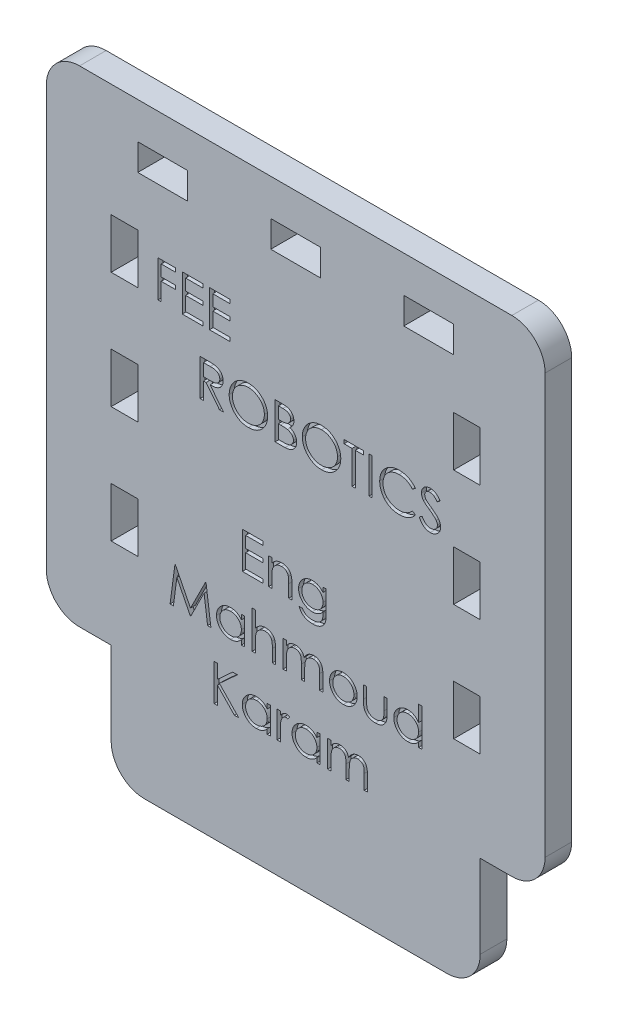
from build123d import *

# Parameters (mm, degrees)
SKETCH1_W           = 15
SKETCH1_H           = 8
SKETCH1_W_2         = 8
SKETCH1_H_2         = 15
BOSS_EXTRUDE1_DEPTH = 8
SKETCH2_W           = 0.987179487
SKETCH2_H           = 11
CUT_EXTRUDE1_DEPTH  = 1.5


with BuildPart() as part:
    # Sketch1 → Boss-Extrude1 (new body)
    with BuildSketch(Plane.XY):
        with BuildLine():
            Line((-65, 90.562589032), (65, 90.562589032))
            ThreePointArc((65, 90.562589032), (72.071067812, 87.633656843), (75, 80.562589032))
            Line((75, 80.562589032), (75, -45.562589032))
            ThreePointArc((75, -45.562589032), (72.071067812, -52.633656843), (65, -55.562589032))
            Line((65, -55.562589032), (55.5, -55.562589032))
            Line((55.5, -55.562589032), (55.5, -80.562589032))
            ThreePointArc((55.5, -80.562589032), (52.571067812, -87.633656843), (45.5, -90.562589032))
            Line((45.5, -90.562589032), (-45.5, -90.562589032))
            ThreePointArc((-45.5, -90.562589032), (-52.571067812, -87.633656843), (-55.5, -80.562589032))
            Line((-55.5, -80.562589032), (-55.5, -55.562589032))
            Line((-55.5, -55.562589032), (-65, -55.562589032))
            ThreePointArc((-65, -55.562589032), (-72.071067812, -52.633656843), (-75, -45.562589032))
            Line((-75, -45.562589032), (-75, 80.562589032))
            ThreePointArc((-75, 80.562589032), (-72.071067812, 87.633656843), (-65, 90.562589032))
        make_face()
        with Locations((0, 75.562589032)):
            Rectangle(SKETCH1_W, SKETCH1_H, mode=Mode.SUBTRACT)
        with Locations((-40, 75.562589032)):
            Rectangle(SKETCH1_W, SKETCH1_H, mode=Mode.SUBTRACT)
        with Locations((40, 75.562589032)):
            Rectangle(SKETCH1_W, SKETCH1_H, mode=Mode.SUBTRACT)
        with Locations((-51.5, 49.062589032)):
            Rectangle(SKETCH1_W_2, SKETCH1_H_2, mode=Mode.SUBTRACT)
        with Locations((-51.5, 14.062589032)):
            Rectangle(SKETCH1_W_2, SKETCH1_H_2, mode=Mode.SUBTRACT)
        with Locations((-51.5, -20.937410968)):
            Rectangle(SKETCH1_W_2, SKETCH1_H_2, mode=Mode.SUBTRACT)
        with Locations((51.5, 49.062589032)):
            Rectangle(SKETCH1_W_2, SKETCH1_H_2, mode=Mode.SUBTRACT)
        with Locations((51.5, -20.937410968)):
            Rectangle(SKETCH1_W_2, SKETCH1_H_2, mode=Mode.SUBTRACT)
        with Locations((51.5, 14.062589032)):
            Rectangle(SKETCH1_W_2, SKETCH1_H_2, mode=Mode.SUBTRACT)
    extrude(amount=BOSS_EXTRUDE1_DEPTH)

    # Sketch2 → Cut-Extrude1 (cut)
    # profile 1 of 26: a face of its own
    with BuildSketch(Plane.XY.offset(8)):
        Polygon((-41.441284645, 52.378519332), (-36.082310286, 52.378519332), (-36.082310286, 51.250314204), (-40.454105158, 51.250314204), (-40.454105158, 47.865698819), (-36.082310286, 47.865698819), (-36.082310286, 46.737493691), (-40.454105158, 46.737493691), (-40.454105158, 41.378519332), (-41.441284645, 41.378519332), align=None)
    # profile 2 of 26: a face of its own
    with BuildSketch(Plane.XY.offset(8)):
        Polygon((-34.107951312, 52.378519332), (-27.902823107, 52.378519332), (-27.902823107, 51.250314204), (-33.120771825, 51.250314204), (-33.120771825, 47.865698819), (-27.902823107, 47.865698819), (-27.902823107, 46.737493691), (-33.120771825, 46.737493691), (-33.120771825, 42.50672446), (-27.902823107, 42.50672446), (-27.902823107, 41.378519332), (-34.107951312, 41.378519332), align=None)
    # profile 3 of 26: a face of its own
    with BuildSketch(Plane.XY.offset(8)):
        Polygon((-25.928464133, 52.378519332), (-19.723335927, 52.378519332), (-19.723335927, 51.250314204), (-24.941284645, 51.250314204), (-24.941284645, 47.865698819), (-19.723335927, 47.865698819), (-19.723335927, 46.737493691), (-24.941284645, 46.737493691), (-24.941284645, 42.50672446), (-19.723335927, 42.50672446), (-19.723335927, 41.378519332), (-25.928464133, 41.378519332), align=None)
    # profile 4 of 26: a face of its own
    with BuildSketch(Plane.XY.offset(8)):
        with BuildLine():
            Line((-28.748976953, 33.045185998), (-26.547654838, 33.045185998))
            add(Edge.make_bspline(
                [(-26.547654838, 33.045185998), (-26.400754148, 33.044697014), (-26.118688551, 33.043758109), (-25.71460113, 33.038522855), (-25.347430254, 33.023517737), (-25.017367902, 33.010605046), (-24.724420129, 32.987058944), (-24.467688644, 32.964554054), (-24.24835588, 32.935093977), (-24.115583205, 32.907734076), (-24.055467338, 32.895346255)],
                knots=[0, 0, 0, 0, 1.410062039, 2.707475311, 3.878576406, 4.937260626, 5.877586885, 6.699081471, 7.410979367, 8, 8, 8, 8], degree=3))
            add(Edge.make_bspline(
                [(-24.055467338, 32.895346255), (-23.974989376, 32.875462135), (-23.815750266, 32.836118078), (-23.58647863, 32.752959333), (-23.368005041, 32.656726227), (-23.161237021, 32.543697391), (-22.967210249, 32.413033798), (-22.783924129, 32.266991128), (-22.610546959, 32.106368481), (-22.454090407, 31.927116122), (-22.306567673, 31.73905852), (-22.182146275, 31.535703856), (-22.074891625, 31.323053341), (-21.989498571, 31.098944313), (-21.920739226, 30.865550173), (-21.87225676, 30.620756812), (-21.843181598, 30.365679462), (-21.840221481, 30.191697463), (-21.838720543, 30.103479268)],
                knots=[0, 0, 0, 0, 1.027469482, 2.033020251, 3.019912614, 3.986113645, 4.951240523, 5.91722682, 6.890402269, 7.87763091, 8.8651537, 9.85103654, 10.82876324, 11.815024772, 12.821070561, 13.842952187, 14.906261191, 16, 16, 16, 16], degree=3))
            add(Edge.make_bspline(
                [(-21.838720543, 30.103479268), (-21.843337394, 29.956911796), (-21.852346066, 29.670920697), (-21.936339249, 29.255872213), (-22.073922597, 28.868705795), (-22.263510077, 28.509908933), (-22.504942715, 28.186475476), (-22.795106344, 27.902391188), (-23.134162837, 27.664665749), (-23.44979783, 27.499814077), (-23.728613886, 27.394236364), (-23.958147155, 27.319950665), (-24.208529084, 27.262555917), (-24.477360708, 27.21113836), (-24.765760768, 27.172318749), (-25.073038034, 27.143886595), (-25.399411654, 27.126116727), (-25.623620157, 27.123470426), (-25.738960927, 27.122109075)],
                knots=[0, 0, 0, 0, 1.260483769, 2.459530307, 3.627416485, 4.787058657, 5.939039949, 7.08810263, 8.267026773, 9.491475466, 10.141966685, 10.831826277, 11.566392101, 12.351337768, 13.187381173, 14.07005841, 15.007169909, 16, 16, 16, 16], degree=3))
            Line((-25.738960927, 27.122109075), (-21.697694902, 22.045185998))
            Line((-21.697694902, 22.045185998), (-22.918448107, 22.045185998))
            Line((-22.918448107, 22.045185998), (-26.959714133, 27.122109075))
            Line((-26.959714133, 27.122109075), (-27.761797466, 27.122109075))
            Line((-27.761797466, 27.122109075), (-27.761797466, 22.045185998))
            Line((-27.761797466, 22.045185998), (-28.748976953, 22.045185998))
            Line((-28.748976953, 22.045185998), (-28.748976953, 33.045185998))
        make_face()
        with BuildLine():
            Line((-27.761797466, 31.91698087), (-27.761797466, 28.250314204))
            Line((-27.761797466, 28.250314204), (-25.74777503, 28.234889524))
            add(Edge.make_bspline(
                [(-25.74777503, 28.234889524), (-25.653740622, 28.234847923), (-25.471475157, 28.234767289), (-25.207787353, 28.247319157), (-24.962267002, 28.261598157), (-24.735853209, 28.283438957), (-24.52844483, 28.311586611), (-24.340145531, 28.34679599), (-24.170647939, 28.387816759), (-23.972966819, 28.451307583), (-23.752223434, 28.551897926), (-23.512324561, 28.698246636), (-23.308031499, 28.882321011), (-23.135432503, 29.092809015), (-22.996740004, 29.324237226), (-22.898959262, 29.573831529), (-22.836911586, 29.835290837), (-22.829593301, 30.014993462), (-22.82590003, 30.105682793)],
                knots=[0, 0, 0, 0, 1.146690395, 2.22261258, 3.21895312, 4.145990853, 4.996080663, 5.770904154, 6.481378293, 7.121626537, 8.300444488, 9.431385265, 10.535395872, 11.636531494, 12.74115979, 13.810798291, 14.895190096, 16, 16, 16, 16], degree=3))
            add(Edge.make_bspline(
                [(-22.82590003, 30.105682793), (-22.829678125, 30.194143454), (-22.83716493, 30.369440204), (-22.898289631, 30.626073065), (-23.001656258, 30.868283479), (-23.14095472, 31.095086146), (-23.31066635, 31.300961316), (-23.50966519, 31.477109512), (-23.732510089, 31.622464972), (-23.940790998, 31.715350168), (-24.126955666, 31.772298278), (-24.288591741, 31.812373364), (-24.471227813, 31.844570267), (-24.675750683, 31.87036703), (-24.901287237, 31.892539711), (-25.148977855, 31.907473873), (-25.417179164, 31.916317446), (-25.60306952, 31.916754582), (-25.699297466, 31.91698087)],
                knots=[0, 0, 0, 0, 1.101028733, 2.181837193, 3.264309656, 4.369019818, 5.486613113, 6.575447106, 7.666700264, 8.788928104, 9.402425223, 10.0903467, 10.862060571, 11.710948788, 12.657782767, 13.684531032, 14.801375019, 16, 16, 16, 16], degree=3))
            Line((-25.699297466, 31.91698087), (-27.761797466, 31.91698087))
        make_face(mode=Mode.SUBTRACT)
    # profile 5 of 26: a face of its own
    with BuildSketch(Plane.XY.offset(8)):
        with BuildLine():
            add(Edge.make_bspline(
                [(-14.293848748, 33.327237281), (-14.090166129, 33.322078345), (-13.690116662, 33.311945771), (-13.102166983, 33.234382874), (-12.540868112, 33.100197363), (-12.001647676, 32.921485132), (-11.490955464, 32.683085635), (-11.004947516, 32.394932312), (-10.544780198, 32.054006299), (-10.116655856, 31.662943014), (-9.72487687, 31.237452159), (-9.379709799, 30.783378728), (-9.090434018, 30.303468206), (-8.852878687, 29.799162738), (-8.666511628, 29.271602839), (-8.53790892, 28.717975973), (-8.455760448, 28.141869233), (-8.446156576, 27.748927658), (-8.441284645, 27.54959305)],
                knots=[0, 0, 0, 0, 1.065120563, 2.091984664, 3.0946048, 4.079830382, 5.057816894, 6.036188127, 7.030412546, 8.04752943, 9.064399622, 10.05169764, 11.02544977, 11.989514704, 12.962713494, 13.945757189, 14.957906945, 16, 16, 16, 16], degree=3))
            add(Edge.make_bspline(
                [(-8.441284645, 27.54959305), (-8.446155862, 27.35172679), (-8.455757594, 26.961709468), (-8.538002323, 26.389258644), (-8.666988323, 25.838973598), (-8.851148017, 25.311772975), (-9.087570949, 24.807100632), (-9.378772916, 24.326284491), (-9.721788149, 23.869166924), (-10.112152538, 23.440755691), (-10.53769867, 23.047906497), (-10.994136652, 22.705590031), (-11.471201372, 22.411028496), (-11.975031883, 22.175994092), (-12.498946284, 21.988139485), (-13.047633586, 21.860059791), (-13.618522755, 21.777443369), (-14.007831624, 21.767956605), (-14.205707722, 21.763134716)],
                knots=[0, 0, 0, 0, 1.043624062, 2.057103931, 3.04512605, 4.022047818, 4.998200453, 5.980619268, 6.982898556, 8.009068085, 9.034988726, 10.034168286, 11.015286542, 11.987931943, 12.962482838, 13.94673481, 14.956375938, 16, 16, 16, 16], degree=3))
            add(Edge.make_bspline(
                [(-14.205707722, 21.763134716), (-14.405041296, 21.768004218), (-14.797980832, 21.777603302), (-15.374811515, 21.859887717), (-15.928827281, 21.988560386), (-16.458443813, 22.172447185), (-16.963956449, 22.410101339), (-17.446353852, 22.699886531), (-17.903699743, 23.043737546), (-18.332202375, 23.433975351), (-18.724271284, 23.858800229), (-19.066086464, 24.313993602), (-19.355936821, 24.790625038), (-19.592793008, 25.290017256), (-19.780309881, 25.809756076), (-19.908239309, 26.353308434), (-19.991009444, 26.917575452), (-20.000547533, 27.301767418), (-20.005387209, 27.496708434)],
                knots=[0, 0, 0, 0, 1.053102029, 2.075944431, 3.073151272, 4.055350789, 5.033113405, 6.020478099, 7.024410459, 8.052272461, 9.079885166, 10.07527673, 11.055994387, 12.023226415, 12.992069828, 13.970394897, 14.97016774, 16, 16, 16, 16], degree=3))
            add(Edge.make_bspline(
                [(-20.005387209, 27.496708434), (-20.003706926, 27.627553966), (-20.000367558, 27.887594354), (-19.960165096, 28.273746526), (-19.901828321, 28.653688593), (-19.81822231, 29.026340144), (-19.708877071, 29.390788953), (-19.579856413, 29.749548493), (-19.422274042, 30.098983054), (-19.244134863, 30.440747999), (-19.045312037, 30.769515703), (-18.825702539, 31.080280107), (-18.593019952, 31.375648954), (-18.337935001, 31.647968109), (-18.068854745, 31.905159601), (-17.781414128, 32.143270997), (-17.477367074, 32.364449415), (-17.155405309, 32.563770486), (-16.823462159, 32.744042052), (-16.481278001, 32.898739298), (-16.133500204, 33.031512635), (-15.778499882, 33.139126657), (-15.417219742, 33.224084484), (-15.048871276, 33.281936167), (-14.673747936, 33.322241166), (-14.421026648, 33.325564744), (-14.293848748, 33.327237281)],
                knots=[0, 0, 0, 0, 1.037015668, 2.060948919, 3.074880161, 4.083647147, 5.086022904, 6.090072063, 7.104153813, 8.122640571, 9.144368836, 10.147691507, 11.138137339, 12.123020368, 13.103399296, 14.087645067, 15.080126199, 16.082011238, 17.087798457, 18.072939717, 19.057185487, 20.037253025, 21.01195951, 21.997135196, 22.992090687, 24, 24, 24, 24], degree=3))
        make_face()
        with BuildLine():
            add(Edge.make_bspline(
                [(-14.245371184, 32.199032152), (-14.349760032, 32.19775964), (-14.557539764, 32.195226781), (-14.866434021, 32.161863103), (-15.171265813, 32.114312024), (-15.472098094, 32.046484387), (-15.767672146, 31.95407165), (-16.060743076, 31.84771451), (-16.348638388, 31.718162511), (-16.630407656, 31.571791154), (-16.90356932, 31.40978026), (-17.161323525, 31.230726135), (-17.404337549, 31.038827822), (-17.632016387, 30.833637476), (-17.843691499, 30.614110156), (-18.043529132, 30.383573928), (-18.223519246, 30.135439413), (-18.388473916, 29.876435278), (-18.536087129, 29.60689888), (-18.667349672, 29.329667884), (-18.774722271, 29.042480868), (-18.862289739, 28.748453516), (-18.934889145, 28.4480515), (-18.980881478, 28.138995975), (-19.01461175, 27.822839908), (-19.016999836, 27.609182653), (-19.018207722, 27.501115486)],
                knots=[0, 0, 0, 0, 1.008559885, 2.007477868, 2.99961109, 3.989939068, 4.984837346, 5.991145699, 7.001802488, 8.033829008, 9.059044045, 10.069351652, 11.065060232, 12.050310815, 13.029377138, 14.011219647, 14.996725999, 15.989392538, 16.977580475, 17.965360261, 18.951710183, 19.937753436, 20.929683414, 21.935841486, 22.955955122, 24, 24, 24, 24], degree=3))
            add(Edge.make_bspline(
                [(-19.018207722, 27.501115486), (-19.014201013, 27.342205649), (-19.006318577, 27.029580839), (-18.937309071, 26.571452387), (-18.831011437, 26.131174916), (-18.674316857, 25.711157487), (-18.478357782, 25.307789741), (-18.23627327, 24.924649983), (-17.949459001, 24.561634664), (-17.623659346, 24.221278104), (-17.267502268, 23.910619862), (-16.889313688, 23.637934864), (-16.493145208, 23.407216935), (-16.077963713, 23.219258137), (-15.645985734, 23.070318961), (-15.194427716, 22.968243263), (-14.7262977, 22.90106326), (-14.407201355, 22.894611742), (-14.245371184, 22.891339845)],
                knots=[0, 0, 0, 0, 1.032063989, 2.030389145, 3.003944642, 3.970395727, 4.937377036, 5.913328081, 6.909231446, 7.93887556, 8.970685674, 9.976071282, 10.964166581, 11.944589148, 12.933237628, 13.927779006, 14.949070134, 16, 16, 16, 16], degree=3))
            add(Edge.make_bspline(
                [(-14.245371184, 22.891339845), (-14.136598464, 22.892834287), (-13.920869493, 22.895798215), (-13.599997851, 22.925651199), (-13.2849069, 22.973522789), (-12.976038592, 23.042447706), (-12.67374347, 23.128710355), (-12.376759804, 23.231191786), (-12.088250891, 23.359046997), (-11.804577115, 23.500311988), (-11.53304607, 23.661352483), (-11.273837254, 23.834329525), (-11.033484175, 24.02594519), (-10.805975664, 24.228086887), (-10.593431499, 24.444830409), (-10.397288977, 24.675893963), (-10.218208562, 24.922736029), (-10.05331653, 25.181347304), (-9.906220561, 25.451621241), (-9.778057678, 25.729857371), (-9.669327028, 26.015370572), (-9.581551728, 26.308572654), (-9.512768848, 26.60890675), (-9.465374814, 26.916774996), (-9.432222578, 27.231561501), (-9.429723764, 27.444470762), (-9.428464133, 27.551796575)],
                knots=[0, 0, 0, 0, 1.047197238, 2.076906641, 3.100256066, 4.114471768, 5.12198147, 6.126382909, 7.136867548, 8.15857795, 9.17633901, 10.174870724, 11.156907918, 12.133735059, 13.104061851, 14.077631395, 15.04955518, 16.038496417, 17.029181396, 18.010275684, 18.986308667, 19.968651475, 20.955262928, 21.950658345, 22.966943676, 24, 24, 24, 24], degree=3))
            add(Edge.make_bspline(
                [(-9.428464133, 27.551796575), (-9.429724773, 27.65838816), (-9.432225487, 27.869832204), (-9.465358978, 28.182423347), (-9.512818919, 28.488076297), (-9.581216002, 28.785591107), (-9.669373628, 29.075043614), (-9.778076666, 29.356161964), (-9.906259036, 29.629993434), (-10.053370598, 29.895861225), (-10.218734615, 30.15098183), (-10.399430808, 30.394875127), (-10.598579045, 30.622960885), (-10.810489409, 30.840869923), (-11.040455049, 31.043954719), (-11.287434259, 31.232282641), (-11.548428674, 31.410398646), (-11.824771414, 31.571078983), (-12.109966698, 31.719466572), (-12.402610565, 31.846598296), (-12.699387736, 31.954624957), (-12.999543517, 32.04676399), (-13.305604306, 32.114046371), (-13.615502054, 32.161905956), (-13.92880801, 32.195215169), (-14.139515272, 32.197755787), (-14.245371184, 32.199032152)],
                knots=[0, 0, 0, 0, 1.02996197, 2.043119294, 3.035359645, 4.018872909, 4.991431989, 5.957985074, 6.929999688, 7.912076566, 8.892894881, 9.867085534, 10.843653904, 11.817741046, 12.803660682, 13.806313499, 14.818574707, 15.856120519, 16.894564902, 17.924820532, 18.937903209, 19.946497019, 20.957711757, 21.963978472, 22.977135795, 24, 24, 24, 24], degree=3))
        make_face(mode=Mode.SUBTRACT)
    # profile 6 of 26: a face of its own
    with BuildSketch(Plane.XY.offset(8)):
        with BuildLine():
            Line((-6.184874389, 33.045185998), (-4.038640415, 33.045185998))
            add(Edge.make_bspline(
                [(-4.038640415, 33.045185998), (-3.933579483, 33.04463364), (-3.729945251, 33.043563032), (-3.433827005, 33.026958906), (-3.1564736, 33.0043188), (-2.897804601, 32.968395652), (-2.657939537, 32.925050067), (-2.436155534, 32.872558645), (-2.23315785, 32.809617859), (-1.990803535, 32.709529546), (-1.714481458, 32.560799589), (-1.41528651, 32.341024098), (-1.159444614, 32.072207786), (-0.938859046, 31.768976583), (-0.763484099, 31.435407014), (-0.636609164, 31.079449564), (-0.556284413, 30.705695518), (-0.54802362, 30.449102673), (-0.543848748, 30.319424781)],
                knots=[0, 0, 0, 0, 1.001505555, 1.941167018, 2.826882275, 3.653841531, 4.429895133, 5.150066043, 5.825578002, 6.45369114, 7.647487171, 8.808567382, 9.977351308, 11.170798116, 12.373658725, 13.556498008, 14.765093433, 16, 16, 16, 16], degree=3))
            add(Edge.make_bspline(
                [(-0.543848748, 30.319424781), (-0.547284577, 30.19794532), (-0.554036306, 29.959226723), (-0.618599264, 29.610073809), (-0.71967565, 29.277712835), (-0.860177862, 28.963356767), (-1.042784136, 28.674108268), (-1.259195995, 28.407634004), (-1.520294517, 28.175216396), (-1.715916128, 28.045281559), (-1.815283043, 27.97928055)],
                knots=[0, 0, 0, 0, 1.044552857, 2.05264487, 3.044412934, 4.028983338, 5.005914585, 5.980388656, 6.974128949, 8, 8, 8, 8], degree=3))
            add(Edge.make_bspline(
                [(-1.815283043, 27.97928055), (-1.690321699, 27.931304839), (-1.451239693, 27.839515419), (-1.122226511, 27.677232532), (-0.838756998, 27.500723043), (-0.598651682, 27.307965799), (-0.393304767, 27.100195251), (-0.213995522, 26.874364892), (-0.060996917, 26.627528796), (0.070100843, 26.362260542), (0.172396933, 26.081268784), (0.249006918, 25.787189202), (0.292904615, 25.481076314), (0.299151488, 25.272750836), (0.302305098, 25.167581832)],
                knots=[0, 0, 0, 0, 1.27268992, 2.434971085, 3.483601985, 4.442670788, 5.356604649, 6.2567628, 7.179492994, 8.113709626, 9.066344395, 10.018646069, 10.999752585, 12, 12, 12, 12], degree=3))
            add(Edge.make_bspline(
                [(0.302305098, 25.167581832), (0.299235011, 25.060200234), (0.293194528, 24.848923931), (0.248628902, 24.538550651), (0.173171709, 24.241943676), (0.06923382, 23.95718453), (-0.066419169, 23.684824108), (-0.231507057, 23.42455385), (-0.428349114, 23.17898881), (-0.648546702, 22.945400281), (-0.897656302, 22.735370092), (-1.166420103, 22.548320728), (-1.458222823, 22.394490247), (-1.768271947, 22.265268465), (-2.100045512, 22.166560127), (-2.452053706, 22.097503466), (-2.823992941, 22.05097335), (-3.079223587, 22.047147849), (-3.210114774, 22.045185998)],
                knots=[0, 0, 0, 0, 0.978564426, 1.925352924, 2.850884081, 3.763762016, 4.682927383, 5.618979971, 6.567305752, 7.547517671, 8.540179244, 9.531824382, 10.526200242, 11.540722885, 12.589160233, 13.674978461, 14.80764778, 16, 16, 16, 16], degree=3))
            Line((-3.210114774, 22.045185998), (-6.184874389, 22.045185998))
            Line((-6.184874389, 22.045185998), (-6.184874389, 33.045185998))
        make_face()
        with BuildLine():
            Line((-5.197694902, 31.91698087), (-5.197694902, 28.391339845))
            Line((-5.197694902, 28.391339845), (-4.534433684, 28.391339845))
            add(Edge.make_bspline(
                [(-4.534433684, 28.391339845), (-4.437480327, 28.392596746), (-4.250146684, 28.395025334), (-3.97885558, 28.401982102), (-3.727034094, 28.421461667), (-3.495116905, 28.440935634), (-3.283469224, 28.472598623), (-3.092559945, 28.510288152), (-2.919392926, 28.550148711), (-2.719697211, 28.617938527), (-2.49318223, 28.718125506), (-2.25170676, 28.87360842), (-2.038826999, 29.058799244), (-1.859064409, 29.272485124), (-1.711942644, 29.507778851), (-1.609756682, 29.76092619), (-1.540465218, 30.025618033), (-1.534206119, 30.207332542), (-1.531028235, 30.29959305)],
                knots=[0, 0, 0, 0, 1.156816544, 2.235205308, 3.236616184, 4.169592532, 5.011045266, 5.787822928, 6.49130361, 7.128639758, 8.301311294, 9.436451833, 10.541879658, 11.654887649, 12.756523258, 13.837046038, 14.901820046, 16, 16, 16, 16], degree=3))
            add(Edge.make_bspline(
                [(-1.531028235, 30.29959305), (-1.532681944, 30.360645475), (-1.535925875, 30.480406473), (-1.562493398, 30.654990157), (-1.607648632, 30.819184808), (-1.665647839, 30.975240583), (-1.746698004, 31.118277827), (-1.842126031, 31.253242156), (-1.957423915, 31.375537386), (-2.088661183, 31.489841523), (-2.239545427, 31.591181468), (-2.409986629, 31.679938152), (-2.602290757, 31.751409164), (-2.813216873, 31.814002786), (-3.046011719, 31.857965996), (-3.297988887, 31.894590928), (-3.57121229, 31.913236689), (-3.760239755, 31.915704972), (-3.857951312, 31.91698087)],
                knots=[0, 0, 0, 0, 0.91205012, 1.789085906, 2.630437955, 3.453916878, 4.269457761, 5.079663411, 5.91843418, 6.774407191, 7.675494373, 8.627863946, 9.638891023, 10.736472738, 11.911756761, 13.175263542, 14.539845004, 16, 16, 16, 16], degree=3))
            Line((-3.857951312, 31.91698087), (-5.197694902, 31.91698087))
        make_face(mode=Mode.SUBTRACT)
        with BuildLine():
            Line((-5.197694902, 27.263134716), (-5.197694902, 23.173391127))
            Line((-5.197694902, 23.173391127), (-3.791845543, 23.173391127))
            add(Edge.make_bspline(
                [(-3.791845543, 23.173391127), (-3.691214633, 23.17459719), (-3.49726182, 23.176921718), (-3.217229383, 23.184510318), (-2.957682485, 23.201771756), (-2.719805487, 23.228944426), (-2.501029779, 23.258419552), (-2.303979855, 23.298055006), (-2.12705839, 23.343466025), (-1.921910565, 23.413659138), (-1.690899539, 23.522705189), (-1.441951134, 23.68712133), (-1.220611591, 23.882994583), (-1.032652205, 24.109691741), (-0.878611384, 24.356190198), (-0.766551382, 24.617504155), (-0.697437261, 24.889315812), (-0.689070443, 25.074639766), (-0.684874389, 25.167581832)],
                knots=[0, 0, 0, 0, 1.160039823, 2.235823828, 3.228722157, 4.157150951, 4.99529583, 5.772374946, 6.472645482, 7.099169577, 8.269452708, 9.405989375, 10.527446681, 11.663510218, 12.788923519, 13.866172445, 14.929861265, 16, 16, 16, 16], degree=3))
            add(Edge.make_bspline(
                [(-0.684874389, 25.167581832), (-0.685742145, 25.225703759), (-0.687463661, 25.341010102), (-0.713425594, 25.510459819), (-0.751183471, 25.674598278), (-0.799996548, 25.833871177), (-0.871086302, 25.985398931), (-0.954078301, 26.132178404), (-1.051385563, 26.274403625), (-1.203010084, 26.454213565), (-1.423550607, 26.661381319), (-1.736914759, 26.864213469), (-2.093227695, 27.027792292), (-2.351656958, 27.097247789), (-2.485154838, 27.133126704)],
                knots=[0, 0, 0, 0, 0.723448775, 1.435228256, 2.130040452, 2.821711965, 3.505591119, 4.210454504, 4.921174351, 5.648778258, 7.137944449, 8.670945889, 10.280296675, 12, 12, 12, 12], degree=3))
            add(Edge.make_bspline(
                [(-2.485154838, 27.133126704), (-2.538674853, 27.143985539), (-2.654717286, 27.167529734), (-2.84394111, 27.192382516), (-3.059968127, 27.214524133), (-3.30329717, 27.230902057), (-3.574236099, 27.247831193), (-3.873363558, 27.254414917), (-4.199457975, 27.262269734), (-4.425719717, 27.262839013), (-4.543247786, 27.263134716)],
                knots=[0, 0, 0, 0, 0.634451884, 1.375622551, 2.216452059, 3.157844607, 4.20941857, 5.370758133, 6.634282058, 8, 8, 8, 8], degree=3))
            Line((-4.543247786, 27.263134716), (-5.197694902, 27.263134716))
        make_face(mode=Mode.SUBTRACT)
    # profile 7 of 26: a face of its own
    with BuildSketch(Plane.XY.offset(8)):
        with BuildLine():
            add(Edge.make_bspline(
                [(7.706151252, 33.327237281), (7.909833871, 33.322078345), (8.309883338, 33.311945771), (8.897833017, 33.234382874), (9.459131888, 33.100197363), (9.998352324, 32.921485132), (10.509044536, 32.683085635), (10.995052484, 32.394932312), (11.455219802, 32.054006299), (11.883344144, 31.662943014), (12.27512313, 31.237452159), (12.620290201, 30.783378728), (12.909565982, 30.303468206), (13.147121313, 29.799162738), (13.333488372, 29.271602839), (13.46209108, 28.717975973), (13.544239552, 28.141869233), (13.553843424, 27.748927658), (13.558715355, 27.54959305)],
                knots=[0, 0, 0, 0, 1.065120563, 2.091984664, 3.0946048, 4.079830382, 5.057816894, 6.036188127, 7.030412546, 8.04752943, 9.064399622, 10.05169764, 11.02544977, 11.989514704, 12.962713494, 13.945757189, 14.957906945, 16, 16, 16, 16], degree=3))
            add(Edge.make_bspline(
                [(13.558715355, 27.54959305), (13.553844138, 27.35172679), (13.544242406, 26.961709468), (13.461997677, 26.389258644), (13.333011677, 25.838973598), (13.148851983, 25.311772975), (12.912429051, 24.807100632), (12.621227084, 24.326284491), (12.278211851, 23.869166924), (11.887847462, 23.440755691), (11.46230133, 23.047906497), (11.005863348, 22.705590031), (10.528798628, 22.411028496), (10.024968117, 22.175994092), (9.501053716, 21.988139485), (8.952366414, 21.860059791), (8.381477245, 21.777443369), (7.992168376, 21.767956605), (7.794292278, 21.763134716)],
                knots=[0, 0, 0, 0, 1.043624062, 2.057103931, 3.04512605, 4.022047818, 4.998200453, 5.980619268, 6.982898556, 8.009068085, 9.034988726, 10.034168286, 11.015286542, 11.987931943, 12.962482838, 13.94673481, 14.956375938, 16, 16, 16, 16], degree=3))
            add(Edge.make_bspline(
                [(7.794292278, 21.763134716), (7.594958704, 21.768004218), (7.202019168, 21.777603302), (6.625188485, 21.859887717), (6.071172719, 21.988560386), (5.541556187, 22.172447185), (5.036043551, 22.410101339), (4.553646148, 22.699886531), (4.096300257, 23.043737546), (3.667797625, 23.433975351), (3.275728716, 23.858800229), (2.933913536, 24.313993602), (2.644063179, 24.790625038), (2.407206992, 25.290017256), (2.219690119, 25.809756076), (2.091760691, 26.353308434), (2.008990556, 26.917575452), (1.999452467, 27.301767418), (1.994612791, 27.496708434)],
                knots=[0, 0, 0, 0, 1.053102029, 2.075944431, 3.073151272, 4.055350789, 5.033113405, 6.020478099, 7.024410459, 8.052272461, 9.079885166, 10.07527673, 11.055994387, 12.023226415, 12.992069828, 13.970394897, 14.97016774, 16, 16, 16, 16], degree=3))
            add(Edge.make_bspline(
                [(1.994612791, 27.496708434), (1.996293074, 27.627553966), (1.999632442, 27.887594354), (2.039834904, 28.273746526), (2.098171679, 28.653688593), (2.18177769, 29.026340144), (2.291122929, 29.390788953), (2.420143587, 29.749548493), (2.577725958, 30.098983054), (2.755865137, 30.440747999), (2.954687963, 30.769515703), (3.174297461, 31.080280107), (3.406980048, 31.375648954), (3.662064999, 31.647968109), (3.931145255, 31.905159601), (4.218585872, 32.143270997), (4.522632926, 32.364449415), (4.844594691, 32.563770486), (5.176537841, 32.744042052), (5.518721999, 32.898739298), (5.866499796, 33.031512635), (6.221500118, 33.139126657), (6.582780258, 33.224084484), (6.951128724, 33.281936167), (7.326252064, 33.322241166), (7.578973352, 33.325564744), (7.706151252, 33.327237281)],
                knots=[0, 0, 0, 0, 1.037015668, 2.060948919, 3.074880161, 4.083647147, 5.086022904, 6.090072063, 7.104153813, 8.122640571, 9.144368836, 10.147691507, 11.138137339, 12.123020368, 13.103399296, 14.087645067, 15.080126199, 16.082011238, 17.087798457, 18.072939717, 19.057185487, 20.037253025, 21.01195951, 21.997135196, 22.992090687, 24, 24, 24, 24], degree=3))
        make_face()
        with BuildLine():
            add(Edge.make_bspline(
                [(7.754628816, 32.199032152), (7.650239968, 32.19775964), (7.442460236, 32.195226781), (7.133565979, 32.161863103), (6.828734187, 32.114312024), (6.527901906, 32.046484387), (6.232327854, 31.95407165), (5.939256924, 31.84771451), (5.651361612, 31.718162511), (5.369592344, 31.571791154), (5.09643068, 31.40978026), (4.838676475, 31.230726135), (4.595662451, 31.038827822), (4.367983613, 30.833637476), (4.156308501, 30.614110156), (3.956470868, 30.383573928), (3.776480754, 30.135439413), (3.611526084, 29.876435278), (3.463912871, 29.60689888), (3.332650328, 29.329667884), (3.225277729, 29.042480868), (3.137710261, 28.748453516), (3.065110855, 28.4480515), (3.019118522, 28.138995975), (2.98538825, 27.822839908), (2.983000164, 27.609182653), (2.981792278, 27.501115486)],
                knots=[0, 0, 0, 0, 1.008559885, 2.007477868, 2.99961109, 3.989939068, 4.984837346, 5.991145699, 7.001802488, 8.033829008, 9.059044045, 10.069351652, 11.065060232, 12.050310815, 13.029377138, 14.011219647, 14.996725999, 15.989392538, 16.977580475, 17.965360261, 18.951710183, 19.937753436, 20.929683414, 21.935841486, 22.955955122, 24, 24, 24, 24], degree=3))
            add(Edge.make_bspline(
                [(2.981792278, 27.501115486), (2.985798987, 27.342205649), (2.993681423, 27.029580839), (3.062690929, 26.571452387), (3.168988563, 26.131174916), (3.325683143, 25.711157487), (3.521642218, 25.307789741), (3.76372673, 24.924649983), (4.050540999, 24.561634664), (4.376340654, 24.221278104), (4.732497732, 23.910619862), (5.110686312, 23.637934864), (5.506854792, 23.407216935), (5.922036287, 23.219258137), (6.354014266, 23.070318961), (6.805572284, 22.968243263), (7.2737023, 22.90106326), (7.592798645, 22.894611742), (7.754628816, 22.891339845)],
                knots=[0, 0, 0, 0, 1.032063989, 2.030389145, 3.003944642, 3.970395727, 4.937377036, 5.913328081, 6.909231446, 7.93887556, 8.970685674, 9.976071282, 10.964166581, 11.944589148, 12.933237628, 13.927779006, 14.949070134, 16, 16, 16, 16], degree=3))
            add(Edge.make_bspline(
                [(7.754628816, 22.891339845), (7.863401536, 22.892834287), (8.079130507, 22.895798215), (8.400002149, 22.925651199), (8.7150931, 22.973522789), (9.023961408, 23.042447706), (9.32625653, 23.128710355), (9.623240196, 23.231191786), (9.911749109, 23.359046997), (10.195422885, 23.500311988), (10.46695393, 23.661352483), (10.726162746, 23.834329525), (10.966515825, 24.02594519), (11.194024336, 24.228086887), (11.406568501, 24.444830409), (11.602711023, 24.675893963), (11.781791438, 24.922736029), (11.94668347, 25.181347304), (12.093779439, 25.451621241), (12.221942322, 25.729857371), (12.330672972, 26.015370572), (12.418448272, 26.308572654), (12.487231152, 26.60890675), (12.534625186, 26.916774996), (12.567777422, 27.231561501), (12.570276236, 27.444470762), (12.571535867, 27.551796575)],
                knots=[0, 0, 0, 0, 1.047197238, 2.076906641, 3.100256066, 4.114471768, 5.12198147, 6.126382909, 7.136867548, 8.15857795, 9.17633901, 10.174870724, 11.156907918, 12.133735059, 13.104061851, 14.077631395, 15.04955518, 16.038496417, 17.029181396, 18.010275684, 18.986308667, 19.968651475, 20.955262928, 21.950658345, 22.966943676, 24, 24, 24, 24], degree=3))
            add(Edge.make_bspline(
                [(12.571535867, 27.551796575), (12.570275227, 27.65838816), (12.567774513, 27.869832204), (12.534641022, 28.182423347), (12.487181081, 28.488076297), (12.418783998, 28.785591107), (12.330626372, 29.075043614), (12.221923334, 29.356161964), (12.093740964, 29.629993434), (11.946629402, 29.895861225), (11.781265385, 30.15098183), (11.600569192, 30.394875127), (11.401420955, 30.622960885), (11.189510591, 30.840869923), (10.959544951, 31.043954719), (10.712565741, 31.232282641), (10.451571326, 31.410398646), (10.175228586, 31.571078983), (9.890033302, 31.719466572), (9.597389435, 31.846598296), (9.300612264, 31.954624957), (9.000456483, 32.04676399), (8.694395694, 32.114046371), (8.384497946, 32.161905956), (8.07119199, 32.195215169), (7.860484728, 32.197755787), (7.754628816, 32.199032152)],
                knots=[0, 0, 0, 0, 1.02996197, 2.043119294, 3.035359645, 4.018872909, 4.991431989, 5.957985074, 6.929999688, 7.912076566, 8.892894881, 9.867085534, 10.843653904, 11.817741046, 12.803660682, 13.806313499, 14.818574707, 15.856120519, 16.894564902, 17.924820532, 18.937903209, 19.946497019, 20.957711757, 21.963978472, 22.977135795, 24, 24, 24, 24], degree=3))
        make_face(mode=Mode.SUBTRACT)
    # profile 8 of 26: a face of its own
    with BuildSketch(Plane.XY.offset(8)):
        Polygon((14.545894842, 31.91698087), (14.545894842, 33.045185998), (20.327946124, 33.045185998), (20.327946124, 31.91698087), (17.930510226, 31.91698087), (17.930510226, 22.045185998), (16.943330739, 22.045185998), (16.943330739, 31.91698087), align=None)
    # profile 9 of 26: a face of its own
    with BuildSketch(Plane.XY.offset(8)):
        with Locations((22.51384356, 27.545185998)):
            Rectangle(SKETCH2_W, SKETCH2_H)
    # profile 10 of 26: a face of its own
    with BuildSketch(Plane.XY.offset(8)):
        with BuildLine():
            Line((35.981792278, 31.026756511), (35.118010226, 30.365698819))
            add(Edge.make_bspline(
                [(35.118010226, 30.365698819), (35.05639172, 30.439134724), (34.933985459, 30.585016459), (34.737056537, 30.789866456), (34.531822802, 30.981785849), (34.318362706, 31.1616889), (34.092834045, 31.323284449), (33.860700107, 31.47499363), (33.618077679, 31.610977949), (33.282572227, 31.77586162), (32.84367899, 31.947920964), (32.291180924, 32.092188262), (31.714431757, 32.184026243), (31.320953587, 32.193972888), (31.120814714, 32.199032152)],
                knots=[0, 0, 0, 0, 0.757959112, 1.505699292, 2.245454638, 2.979532153, 3.711538275, 4.438200793, 5.171680507, 5.909471876, 7.393775596, 8.890124382, 10.418191784, 12, 12, 12, 12], degree=3))
            add(Edge.make_bspline(
                [(31.120814714, 32.199032152), (31.010552916, 32.197762556), (30.791052653, 32.195235146), (30.465300308, 32.161892181), (30.145630719, 32.115028378), (29.832251825, 32.045491648), (29.525562527, 31.957577702), (29.223557834, 31.852526401), (28.930610235, 31.722554048), (28.642667201, 31.578899516), (28.36678968, 31.416641833), (28.10575953, 31.239657013), (27.860528774, 31.049925567), (27.630903422, 30.846736375), (27.416648727, 30.631004499), (27.219317179, 30.400430854), (27.039591603, 30.155752595), (26.873909525, 29.900196171), (26.725526648, 29.634505969), (26.601289885, 29.357698604), (26.491273786, 29.074514281), (26.404219024, 28.781753489), (26.335313399, 28.481476225), (26.287769315, 28.172876606), (26.254805548, 27.856599327), (26.252290706, 27.642227202), (26.251023047, 27.53416837)],
                knots=[0, 0, 0, 0, 1.054917814, 2.100044995, 3.131103042, 4.146048494, 5.169673617, 6.183595914, 7.203665975, 8.234915748, 9.262203917, 10.264457458, 11.251630812, 12.227803204, 13.197192746, 14.159520551, 15.12972552, 16.100847026, 17.073214652, 18.039054194, 19.002613845, 19.979014051, 20.95965708, 21.949030935, 22.966165397, 24, 24, 24, 24], degree=3))
            add(Edge.make_bspline(
                [(26.251023047, 27.53416837), (26.254988764, 27.371584222), (26.262774923, 27.052371812), (26.332069687, 26.584807036), (26.437371403, 26.136884919), (26.595191787, 25.711405414), (26.789794518, 25.303122003), (27.035693583, 24.91894275), (27.320488414, 24.553062119), (27.648208018, 24.21412714), (28.007769154, 23.904512575), (28.393548305, 23.63186789), (28.804584638, 23.404592545), (29.236339761, 23.215468142), (29.692136119, 23.070089855), (30.17115407, 22.967745467), (30.672351769, 22.900984328), (31.014827026, 22.894592737), (31.189124008, 22.891339845)],
                knots=[0, 0, 0, 0, 1.029171465, 2.020641659, 2.987623507, 3.938342917, 4.889210282, 5.84687017, 6.821220943, 7.821438502, 8.827599549, 9.822697543, 10.807740252, 11.797342354, 12.80366471, 13.83203677, 14.896651826, 16, 16, 16, 16], degree=3))
            add(Edge.make_bspline(
                [(31.189124008, 22.891339845), (31.381161031, 22.896647438), (31.759135831, 22.907094052), (32.313435342, 22.995594549), (32.844062034, 23.139090862), (33.351044449, 23.339912904), (33.832953337, 23.600975237), (34.290542841, 23.917454281), (34.724199205, 24.292360469), (34.984966092, 24.578621729), (35.118010226, 24.724673178)],
                knots=[0, 0, 0, 0, 1.028121516, 2.023589091, 2.998037872, 3.967518031, 4.937445131, 5.927275754, 6.942489185, 8, 8, 8, 8], degree=3))
            Line((35.118010226, 24.724673178), (35.981792278, 24.070226063))
            add(Edge.make_bspline(
                [(35.981792278, 24.070226063), (35.912278218, 23.980533785), (35.773583067, 23.801578851), (35.549000728, 23.549296335), (35.312414936, 23.311997938), (35.062068419, 23.091596842), (34.800841074, 22.883682808), (34.524042378, 22.694162766), (34.235311133, 22.520391416), (33.935625628, 22.361278224), (33.625304274, 22.220109734), (33.304718907, 22.099255035), (32.975251384, 21.995148239), (32.636886643, 21.909499295), (32.288922836, 21.842647317), (31.932615631, 21.797956911), (31.567196024, 21.767339465), (31.320665843, 21.764548873), (31.195734585, 21.763134716)],
                knots=[0, 0, 0, 0, 0.986787822, 1.968848986, 2.935600012, 3.899624008, 4.868462664, 5.837806735, 6.815139263, 7.798259679, 8.787526145, 9.778297419, 10.776456485, 11.791383307, 12.812564526, 13.85620153, 14.913611965, 16, 16, 16, 16], degree=3))
            add(Edge.make_bspline(
                [(31.195734585, 21.763134716), (31.077425918, 21.763958122), (30.843485177, 21.765586303), (30.498089101, 21.791961687), (30.161836132, 21.827946574), (29.835687308, 21.882129843), (29.517862815, 21.946069198), (29.211243836, 22.031778861), (28.912813174, 22.127790528), (28.623769818, 22.240634772), (28.343867904, 22.367971345), (28.074010211, 22.511887673), (27.814320852, 22.671173534), (27.562246673, 22.842317852), (27.32151141, 23.030817944), (27.090028901, 23.234055938), (26.866501119, 23.451346829), (26.728206966, 23.608033511), (26.658675291, 23.686812601)],
                knots=[0, 0, 0, 0, 1.114604814, 2.203992996, 3.262667896, 4.300477797, 5.318619304, 6.316056647, 7.298880507, 8.271930387, 9.238335007, 10.195173496, 11.151986948, 12.108099108, 13.064862484, 14.031167946, 15.010108607, 16, 16, 16, 16], degree=3))
            add(Edge.make_bspline(
                [(26.658675291, 23.686812601), (26.547306125, 23.823656338), (26.325912341, 24.095691713), (26.042660193, 24.536590511), (25.800196448, 24.996919168), (25.60415784, 25.479096087), (25.450903535, 25.982039304), (25.344734065, 26.506002349), (25.275743308, 27.050495882), (25.267853829, 27.420840075), (25.26384356, 27.609088242)],
                knots=[0, 0, 0, 0, 0.994628077, 1.977248131, 2.950237994, 3.925870899, 4.908910175, 5.911660606, 6.938484602, 8, 8, 8, 8], degree=3))
            add(Edge.make_bspline(
                [(25.26384356, 27.609088242), (25.268731311, 27.806948239), (25.278347656, 28.19622543), (25.360048728, 28.767514998), (25.49147923, 29.314847966), (25.678155166, 29.837202592), (25.914829127, 30.337326329), (26.207198485, 30.811398688), (26.551866646, 31.262451486), (26.94613043, 31.683640705), (27.378484912, 32.068764384), (27.841486899, 32.407583882), (28.334230161, 32.689553218), (28.851286266, 32.925255443), (29.39652698, 33.106423755), (29.968788997, 33.233248056), (30.566997015, 33.312187565), (30.975136067, 33.32216679), (31.182513432, 33.327237281)],
                knots=[0, 0, 0, 0, 1.032925535, 2.032216505, 3.007276963, 3.968222605, 4.92396291, 5.891752235, 6.871517503, 7.883894988, 8.900124299, 9.891468569, 10.874487609, 11.85992873, 12.854644235, 13.869047385, 14.917252991, 16, 16, 16, 16], degree=3))
            add(Edge.make_bspline(
                [(31.182513432, 33.327237281), (31.308901772, 33.325721989), (31.559074763, 33.322722622), (31.929154528, 33.293474747), (32.289458984, 33.244717699), (32.640236356, 33.178352908), (32.98319315, 33.095987041), (33.315708193, 32.98868896), (33.639732637, 32.866002719), (33.95322292, 32.724704683), (34.254674935, 32.566094924), (34.543994793, 32.391931536), (34.818884349, 32.202430433), (35.081277873, 31.99920331), (35.326785965, 31.777950695), (35.562379183, 31.544758251), (35.780056857, 31.292909089), (35.914424041, 31.11563644), (35.981792278, 31.026756511)],
                knots=[0, 0, 0, 0, 1.096760587, 2.17092713, 3.219439832, 4.250915756, 5.268269357, 6.278326846, 7.281116186, 8.274029601, 9.260640565, 10.235837813, 11.203064059, 12.156899882, 13.114053108, 14.069676657, 15.032185724, 16, 16, 16, 16], degree=3))
        make_face()
    # profile 11 of 26: a face of its own
    with BuildSketch(Plane.XY.offset(8)):
        with BuildLine():
            Line((37.109997406, 24.167181191), (38.039885226, 24.724673178))
            add(Edge.make_bspline(
                [(38.039885226, 24.724673178), (38.126371115, 24.579899397), (38.29207474, 24.302518419), (38.568493297, 23.927707435), (38.854911018, 23.609140656), (39.153448923, 23.348671318), (39.46228476, 23.143603388), (39.783434643, 22.998396374), (40.115816334, 22.90783188), (40.342019773, 22.896831608), (40.454949329, 22.891339845)],
                knots=[0, 0, 0, 0, 1.272034388, 2.437168799, 3.508375237, 4.49857839, 5.41946034, 6.295179144, 7.148887113, 8, 8, 8, 8], degree=3))
            add(Edge.make_bspline(
                [(40.454949329, 22.891339845), (40.551393748, 22.894025958), (40.742595034, 22.899351185), (41.02407637, 22.95051942), (41.297447748, 23.029128968), (41.557074895, 23.141709038), (41.799375398, 23.277915708), (42.011853583, 23.442432266), (42.195541368, 23.626623198), (42.345798585, 23.832111541), (42.461078696, 24.053108294), (42.549682339, 24.279946998), (42.598852571, 24.51619107), (42.60625951, 24.675252524), (42.609997406, 24.755522537)],
                knots=[0, 0, 0, 0, 1.095163259, 2.171163733, 3.241058638, 4.321873601, 5.38011039, 6.391990106, 7.366004449, 8.327778327, 9.272591725, 10.192022065, 11.087607919, 12, 12, 12, 12], degree=3))
            add(Edge.make_bspline(
                [(42.609997406, 24.755522537), (42.605363858, 24.847108065), (42.595944532, 25.033288059), (42.516331309, 25.307972683), (42.391090819, 25.579806474), (42.275551082, 25.747953309), (42.215566316, 25.835250101)],
                knots=[0, 0, 0, 0, 0.938893495, 1.908633276, 2.914225137, 4, 4, 4, 4], degree=3))
            add(Edge.make_bspline(
                [(42.215566316, 25.835250101), (42.166315814, 25.898254404), (42.062920547, 26.030524056), (41.885168364, 26.227409082), (41.676589148, 26.430495542), (41.444320832, 26.647538292), (41.179902553, 26.868442796), (40.891616079, 27.103743098), (40.572101094, 27.344490912), (40.348016962, 27.505947546), (40.232393239, 27.589256511)],
                knots=[0, 0, 0, 0, 0.722233717, 1.516239348, 2.393582979, 3.351407094, 4.387010283, 5.505090956, 6.712668013, 8, 8, 8, 8], degree=3))
            add(Edge.make_bspline(
                [(40.232393239, 27.589256511), (40.11666068, 27.671689215), (39.895388839, 27.829294268), (39.58594758, 28.063199161), (39.309236411, 28.277051322), (39.066485216, 28.472863932), (38.857800769, 28.650663546), (38.68153862, 28.808742784), (38.542188869, 28.951376832), (38.464699901, 29.043906763), (38.429909265, 29.085450422)],
                knots=[0, 0, 0, 0, 1.452282411, 2.77665338, 3.964542531, 5.026858415, 5.96415736, 6.766646006, 7.446254459, 8, 8, 8, 8], degree=3))
            add(Edge.make_bspline(
                [(38.429909265, 29.085450422), (38.381281266, 29.150196537), (38.285647779, 29.277528464), (38.159411762, 29.476549445), (38.05211725, 29.680279708), (37.968007063, 29.889266711), (37.897178947, 30.100576487), (37.849539736, 30.316966117), (37.819709631, 30.537464632), (37.816654817, 30.685849919), (37.815125611, 30.760129909)],
                knots=[0, 0, 0, 0, 1.068054152, 2.10047183, 3.106115577, 4.101338837, 5.06977816, 6.043150881, 7.020423561, 8, 8, 8, 8], degree=3))
            add(Edge.make_bspline(
                [(37.815125611, 30.760129909), (37.819227696, 30.8765092), (37.827344188, 31.106780258), (37.895985814, 31.443162868), (38.004329194, 31.764320179), (38.156113127, 32.067072656), (38.351779093, 32.343537168), (38.578209299, 32.596893841), (38.847902541, 32.809880814), (39.143810786, 32.995975854), (39.467702241, 33.141634476), (39.807102223, 33.251511843), (40.162550163, 33.31376951), (40.403302872, 33.322703914), (40.52546215, 33.327237281)],
                knots=[0, 0, 0, 0, 1.005424448, 1.989358655, 2.955360095, 3.929531133, 4.905563448, 5.876582895, 6.856512386, 7.866279853, 8.892233794, 9.918561126, 10.94386622, 12, 12, 12, 12], degree=3))
            add(Edge.make_bspline(
                [(40.52546215, 33.327237281), (40.655086465, 33.322766404), (40.912867856, 33.313875258), (41.292051105, 33.236568731), (41.657127642, 33.108652334), (41.950806474, 32.96348798), (42.180652296, 32.818503531), (42.355938027, 32.686441226), (42.533564301, 32.53440517), (42.714963902, 32.361990397), (42.897063118, 32.167614893), (43.082565396, 31.952609871), (43.271904527, 31.718289267), (43.393708658, 31.551012265), (43.456151252, 31.465258114)],
                knots=[0, 0, 0, 0, 1.286793592, 2.559021753, 3.825965368, 5.121522368, 5.803751409, 6.523245864, 7.299691795, 8.125521123, 9.008227632, 9.944561021, 10.946284179, 12, 12, 12, 12], degree=3))
            Line((43.456151252, 31.465258114), (42.563723367, 30.788775742))
            add(Edge.make_bspline(
                [(42.563723367, 30.788775742), (42.509836151, 30.858197341), (42.406061972, 30.991887108), (42.248512156, 31.179111243), (42.100016405, 31.350134464), (41.953715149, 31.498682009), (41.817335164, 31.632888714), (41.684967317, 31.747790807), (41.558516499, 31.844514107), (41.399120494, 31.947736724), (41.198864808, 32.050057164), (40.947484837, 32.13663998), (40.684785115, 32.188670175), (40.505863416, 32.195549536), (40.415285867, 32.199032152)],
                knots=[0, 0, 0, 0, 1.181633172, 2.275549214, 3.290209073, 4.226197932, 5.078386478, 5.862611352, 6.581680152, 7.217281963, 8.414376989, 9.595101626, 10.782541182, 12, 12, 12, 12], degree=3))
            add(Edge.make_bspline(
                [(40.415285867, 32.199032152), (40.301651083, 32.195223952), (40.082517105, 32.187880198), (39.771404935, 32.10767453), (39.491395456, 31.981388683), (39.25080168, 31.804398752), (39.050485466, 31.594704203), (38.905582596, 31.35339923), (38.818367793, 31.086940251), (38.8077252, 30.901066474), (38.802305098, 30.806403947)],
                knots=[0, 0, 0, 0, 1.14458467, 2.207223713, 3.21896685, 4.227309161, 5.202851033, 6.127160689, 7.046193047, 8, 8, 8, 8], degree=3))
            add(Edge.make_bspline(
                [(38.802305098, 30.806403947), (38.803540639, 30.747470729), (38.806013741, 30.629507925), (38.840505962, 30.455232027), (38.884818139, 30.281396389), (38.955037839, 30.108782557), (39.051980222, 29.934371715), (39.179282203, 29.75516054), (39.339609755, 29.569569455), (39.462423223, 29.448860566), (39.527265034, 29.385129909)],
                knots=[0, 0, 0, 0, 0.858281714, 1.717966888, 2.583508476, 3.4729293, 4.427298488, 5.488583878, 6.674047936, 8, 8, 8, 8], degree=3))
            add(Edge.make_bspline(
                [(39.527265034, 29.385129909), (39.551343633, 29.363642113), (39.608548873, 29.31259203), (39.713130354, 29.229016291), (39.851236291, 29.125921864), (40.019260352, 28.998361726), (40.220300631, 28.850391417), (40.454379236, 28.683902921), (40.718886911, 28.493491479), (40.906584361, 28.36036778), (41.005830739, 28.289977665)],
                knots=[0, 0, 0, 0, 0.420754252, 0.999615792, 1.744751191, 2.668019286, 3.750313428, 4.999500688, 6.413464383, 8, 8, 8, 8], degree=3))
            add(Edge.make_bspline(
                [(41.005830739, 28.289977665), (41.125215038, 28.203104821), (41.356386187, 28.034887598), (41.685310009, 27.782152604), (41.983547692, 27.534973903), (42.252146332, 27.294929995), (42.493759473, 27.063841702), (42.705706595, 26.83892885), (42.890147304, 26.621802764), (43.088710562, 26.343431812), (43.291606567, 26.001548404), (43.465851304, 25.58267394), (43.575720396, 25.162171219), (43.590088016, 24.879544018), (43.597176893, 24.740097857)],
                knots=[0, 0, 0, 0, 1.163667725, 2.253281268, 3.268753668, 4.215851969, 5.092017293, 5.902905408, 6.650798638, 7.335211899, 8.59617414, 9.77448103, 10.901945474, 12, 12, 12, 12], degree=3))
            add(Edge.make_bspline(
                [(43.597176893, 24.740097857), (43.595111602, 24.641480139), (43.591021126, 24.44615979), (43.544001111, 24.15935812), (43.475110735, 23.880803958), (43.371279428, 23.613940462), (43.244549502, 23.353885494), (43.083741295, 23.107460664), (42.897345714, 22.869211982), (42.68352531, 22.645492438), (42.449552474, 22.440118679), (42.202260862, 22.257427343), (41.941245719, 22.105098327), (41.667923009, 21.98079568), (41.382229951, 21.883576054), (41.084262631, 21.813135608), (40.773529881, 21.769903374), (40.562328368, 21.765416123), (40.454949329, 21.763134716)],
                knots=[0, 0, 0, 0, 0.983748083, 1.948392443, 2.894712957, 3.844097841, 4.80183111, 5.778335162, 6.776009319, 7.81870978, 8.863265674, 9.881300176, 10.883814829, 11.87499822, 12.874611388, 13.892143829, 14.928324115, 16, 16, 16, 16], degree=3))
            add(Edge.make_bspline(
                [(40.454949329, 21.763134716), (40.371866823, 21.764741287), (40.206748148, 21.767934196), (39.962518348, 21.796161077), (39.723222496, 21.836097688), (39.491863324, 21.899501908), (39.26546003, 21.97642955), (39.044997293, 22.071150024), (38.830368267, 22.184661229), (38.620370149, 22.314445592), (38.415537029, 22.465484218), (38.21779013, 22.641400921), (38.020641261, 22.837343936), (37.829909444, 23.058634278), (37.641736705, 23.301696824), (37.459833132, 23.568805687), (37.280433448, 23.858505941), (37.167870549, 24.062367639), (37.109997406, 24.167181191)],
                knots=[0, 0, 0, 0, 0.915332311, 1.819136955, 2.706846663, 3.586547465, 4.459518054, 5.340707479, 6.227863349, 7.133153174, 8.059268498, 9.028702269, 10.047606654, 11.120612155, 12.245963614, 13.433783089, 14.680604001, 16, 16, 16, 16], degree=3))
        make_face()
    # profile 12 of 26: a face of its own
    with BuildSketch(Plane.XY.offset(8)):
        Polygon((-16.056669261, -5.621480668), (-9.851541056, -5.621480668), (-9.851541056, -6.749685796), (-15.069489774, -6.749685796), (-15.069489774, -10.134301181), (-9.851541056, -10.134301181), (-9.851541056, -11.262506309), (-15.069489774, -11.262506309), (-15.069489774, -15.49327554), (-9.851541056, -15.49327554), (-9.851541056, -16.621480668), (-16.056669261, -16.621480668), align=None)
    # profile 13 of 26: a face of its own
    with BuildSketch(Plane.XY.offset(8)):
        with BuildLine():
            Line((-8.159233363, -8.58301913), (-7.172053876, -8.58301913))
            Line((-7.172053876, -8.58301913), (-7.172053876, -10.032939002))
            add(Edge.make_bspline(
                [(-7.172053876, -10.032939002), (-7.06664988, -9.901433301), (-6.862109748, -9.646241902), (-6.521473272, -9.310834382), (-6.161478157, -9.034435103), (-5.784329003, -8.814108893), (-5.389513828, -8.648019497), (-4.979439266, -8.528069428), (-4.551650189, -8.456145681), (-4.260733388, -8.446747814), (-4.113560286, -8.441993489)],
                knots=[0, 0, 0, 0, 1.12780773, 2.188550248, 3.19190651, 4.159438251, 5.104880172, 6.052711206, 7.014878035, 8, 8, 8, 8], degree=3))
            add(Edge.make_bspline(
                [(-4.113560286, -8.441993489), (-3.964806865, -8.447478389), (-3.673660538, -8.458213661), (-3.249758059, -8.543123262), (-2.853841679, -8.688151206), (-2.487323075, -8.886817713), (-2.156923261, -9.13386663), (-1.866759443, -9.421682515), (-1.626760665, -9.752738777), (-1.465854667, -10.059868696), (-1.359859774, -10.332319193), (-1.293129571, -10.565666122), (-1.236460772, -10.825637454), (-1.187332421, -11.111447591), (-1.154090069, -11.425099046), (-1.127871439, -11.765306078), (-1.109081257, -12.131958488), (-1.108335749, -12.385545031), (-1.107951312, -12.516312399)],
                knots=[0, 0, 0, 0, 1.235846778, 2.418850247, 3.575807741, 4.728682307, 5.871620074, 6.994088408, 8.11269785, 9.256955736, 9.865816715, 10.540099792, 11.271859618, 12.076849838, 12.949306005, 13.892391288, 14.913166135, 16, 16, 16, 16], degree=3))
            Line((-1.107951312, -12.516312399), (-1.107951312, -16.621480668))
            Line((-1.107951312, -16.621480668), (-2.095130799, -16.621480668))
            Line((-2.095130799, -16.621480668), (-2.095130799, -12.840230668))
            add(Edge.make_bspline(
                [(-2.095130799, -12.840230668), (-2.095738024, -12.730788698), (-2.096899543, -12.521444836), (-2.100563004, -12.22171362), (-2.109393825, -11.94989866), (-2.121802808, -11.706649791), (-2.139965475, -11.49220059), (-2.158893745, -11.306114292), (-2.182040815, -11.148627158), (-2.202667114, -11.053822614), (-2.211917658, -11.011304386)],
                knots=[0, 0, 0, 0, 1.430800155, 2.736877192, 3.918605307, 4.986035426, 5.920637409, 6.731861385, 7.431261377, 8, 8, 8, 8], degree=3))
            add(Edge.make_bspline(
                [(-2.211917658, -11.011304386), (-2.245312186, -10.886497805), (-2.309586319, -10.64628375), (-2.468407409, -10.320450071), (-2.668966263, -10.043255766), (-2.913788075, -9.816414641), (-3.200508027, -9.639877726), (-3.528330476, -9.517388154), (-3.894091918, -9.440777022), (-4.151348549, -9.433148893), (-4.285435286, -9.429172976)],
                knots=[0, 0, 0, 0, 1.084156227, 2.086665306, 3.027808233, 3.945421172, 4.874247719, 5.839848303, 6.874090471, 8, 8, 8, 8], degree=3))
            add(Edge.make_bspline(
                [(-4.285435286, -9.429172976), (-4.364848006, -9.430668991), (-4.522003727, -9.433629565), (-4.755046496, -9.463333644), (-4.981093897, -9.511917362), (-5.202414554, -9.577504508), (-5.414581906, -9.667585926), (-5.624412535, -9.76982109), (-5.824005223, -9.897258327), (-6.017615899, -10.039285995), (-6.197741866, -10.196677789), (-6.365345216, -10.362760535), (-6.514750422, -10.539626718), (-6.650109116, -10.724426553), (-6.766955086, -10.919698044), (-6.868950506, -11.123557293), (-6.955491261, -11.336272618), (-6.998494009, -11.483908525), (-7.020010607, -11.557778745)],
                knots=[0, 0, 0, 0, 1.023777757, 2.026029729, 3.023749952, 4.003683103, 4.997618607, 5.993177895, 7.010360494, 8.046726602, 9.087585522, 10.09234134, 11.086953743, 12.070360549, 13.043493632, 14.017870808, 15.008233677, 16, 16, 16, 16], degree=3))
            add(Edge.make_bspline(
                [(-7.020010607, -11.557778745), (-7.03239236, -11.612009383), (-7.059346787, -11.730066646), (-7.088459638, -11.923806249), (-7.114883447, -12.147923314), (-7.136999602, -12.40215631), (-7.150530911, -12.687395346), (-7.16528473, -13.002422265), (-7.170656065, -13.348493228), (-7.171574891, -13.589429977), (-7.172053876, -13.715030348)],
                knots=[0, 0, 0, 0, 0.615963638, 1.340920617, 2.168419149, 3.115676021, 4.16674242, 5.331190069, 6.6087489, 8, 8, 8, 8], degree=3))
            Line((-7.172053876, -13.715030348), (-7.172053876, -16.621480668))
            Line((-7.172053876, -16.621480668), (-8.159233363, -16.621480668))
            Line((-8.159233363, -16.621480668), (-8.159233363, -8.58301913))
        make_face()
    # profile 14 of 26: a face of its own
    with BuildSketch(Plane.XY.offset(8)):
        with BuildLine():
            Line((8.199740996, -8.58301913), (9.186920483, -8.58301913))
            Line((9.186920483, -8.58301913), (9.186920483, -14.96222586))
            add(Edge.make_bspline(
                [(9.186920483, -14.96222586), (9.186049778, -15.098115444), (9.184369107, -15.360415072), (9.172266054, -15.739689665), (9.146743926, -16.090011648), (9.117802356, -16.412978747), (9.076169819, -16.70709395), (9.025329808, -16.973234879), (8.968017673, -17.211656932), (8.917668418, -17.358506432), (8.893851573, -17.427971053)],
                knots=[0, 0, 0, 0, 1.307562039, 2.523909702, 3.650326591, 4.686913197, 5.643429486, 6.506965704, 7.293745905, 8, 8, 8, 8], degree=3))
            add(Edge.make_bspline(
                [(8.893851573, -17.427971053), (8.858685394, -17.518265092), (8.789404482, -17.696153437), (8.659649634, -17.948318445), (8.51434308, -18.185749956), (8.348379006, -18.407124803), (8.162507908, -18.611331671), (7.961108933, -18.802807097), (7.74025976, -18.977500194), (7.500086664, -19.132396844), (7.246126103, -19.271899014), (6.978524068, -19.392731082), (6.698789547, -19.497975448), (6.404294745, -19.576807091), (6.099656865, -19.645116213), (5.78129351, -19.68957094), (5.45106472, -19.719827408), (5.226522097, -19.722625283), (5.112601573, -19.724044771)],
                knots=[0, 0, 0, 0, 0.981931301, 1.934503488, 2.87077864, 3.801706999, 4.735015492, 5.667491629, 6.616593066, 7.585388521, 8.561939025, 9.551802639, 10.560317337, 11.588439944, 12.640189604, 13.723962949, 14.845264515, 16, 16, 16, 16], degree=3))
            add(Edge.make_bspline(
                [(5.112601573, -19.724044771), (4.946392407, -19.721352958), (4.62174125, -19.716095125), (4.148411273, -19.654837963), (3.698873582, -19.568238505), (3.279068147, -19.437164304), (2.891647842, -19.276762336), (2.539258519, -19.09260677), (2.22506361, -18.881440371), (1.94181778, -18.641009911), (1.686172783, -18.355124054), (1.445658443, -18.018213401), (1.214152626, -17.625146035), (1.078479764, -17.336654651), (1.007433303, -17.185583232)],
                knots=[0, 0, 0, 0, 1.157897085, 2.2616841, 3.32207898, 4.345638746, 5.321241055, 6.241986252, 7.112515963, 7.955008012, 8.825025602, 9.77857164, 10.836726669, 12, 12, 12, 12], degree=3))
            Line((1.007433303, -17.185583232), (1.994612791, -17.185583232))
            add(Edge.make_bspline(
                [(1.994612791, -17.185583232), (2.074008306, -17.31163027), (2.22921676, -17.558036709), (2.519454844, -17.877078056), (2.837531869, -18.149731488), (3.194182302, -18.369451063), (3.590890122, -18.535110408), (4.027893993, -18.653204196), (4.508749947, -18.723906749), (4.843521477, -18.73242796), (5.01784997, -18.736865284)],
                knots=[0, 0, 0, 0, 0.997731894, 1.950442991, 2.880492273, 3.800895997, 4.748200782, 5.754801363, 6.83083817, 8, 8, 8, 8], degree=3))
            add(Edge.make_bspline(
                [(5.01784997, -18.736865284), (5.189974483, -18.73237053), (5.521813314, -18.723705096), (5.998996988, -18.653172643), (6.434581079, -18.535084708), (6.826055995, -18.369744065), (7.168802696, -18.167185645), (7.464268955, -17.940899697), (7.703580794, -17.685759401), (7.864535832, -17.450730868), (7.964587487, -17.241340746), (8.028300231, -17.06108973), (8.080075564, -16.8572664), (8.123383625, -16.630554087), (8.159120781, -16.380628879), (8.181758411, -16.106919325), (8.198119534, -15.810047484), (8.19918801, -15.604211906), (8.199740996, -15.497682591)],
                knots=[0, 0, 0, 0, 1.570740765, 3.028230971, 4.391408896, 5.680370741, 6.894727393, 8.017376726, 9.065722033, 10.075533815, 10.603371122, 11.180248986, 11.817768598, 12.521299649, 13.286540596, 14.121245857, 15.027658897, 16, 16, 16, 16], degree=3))
            Line((8.199740996, -15.497682591), (8.199740996, -15.081216245))
            add(Edge.make_bspline(
                [(8.199740996, -15.081216245), (8.099543198, -15.200461909), (7.900910052, -15.436855742), (7.557875595, -15.746620886), (7.18319386, -16.013405867), (6.777502727, -16.23220729), (6.35073968, -16.407206053), (5.907526956, -16.529598216), (5.451837639, -16.608672187), (5.143045169, -16.617180895), (4.987000611, -16.621480668)],
                knots=[0, 0, 0, 0, 1.012485704, 2.007162095, 2.997754123, 3.998611389, 4.999708251, 5.992315798, 6.98544096, 8, 8, 8, 8], degree=3))
            add(Edge.make_bspline(
                [(4.987000611, -16.621480668), (4.895115193, -16.619862014), (4.712431726, -16.616643859), (4.441031092, -16.588487702), (4.173635429, -16.547634512), (3.91086836, -16.487664275), (3.652350719, -16.410690277), (3.398509715, -16.314466241), (3.14729006, -16.205675869), (2.90325821, -16.077532773), (2.668844656, -15.934965523), (2.445817503, -15.780529009), (2.235344952, -15.615031532), (2.03943027, -15.43684115), (1.858330446, -15.246215761), (1.689609718, -15.045187451), (1.536058056, -14.830949121), (1.394524546, -14.607407255), (1.271772245, -14.373072923), (1.164021362, -14.13302748), (1.070334661, -13.887784195), (0.995643398, -13.636521998), (0.938597042, -13.379399296), (0.896136329, -13.116837313), (0.872052829, -12.848027524), (0.868297354, -12.666931855), (0.866407662, -12.575807591)],
                knots=[0, 0, 0, 0, 1.028754217, 2.045334182, 3.052854819, 4.056607503, 5.061168794, 6.071104265, 7.095078842, 8.125279047, 9.155117945, 10.165957491, 11.161587969, 12.151493252, 13.128948131, 14.104219989, 15.088194871, 16.07871515, 17.064853787, 18.047899887, 19.02414258, 20.002704429, 20.980574569, 21.971845993, 22.979467364, 24, 24, 24, 24], degree=3))
            add(Edge.make_bspline(
                [(0.866407662, -12.575807591), (0.868039328, -12.484655004), (0.871296339, -12.302702876), (0.899427988, -12.032796236), (0.939556584, -11.766503726), (1.003066715, -11.506570137), (1.079508928, -11.250035203), (1.174183014, -10.998793769), (1.2880134, -10.752769312), (1.416901185, -10.511779641), (1.561736905, -10.279058566), (1.720553273, -10.058031965), (1.89354202, -9.850326281), (2.078316612, -9.653846098), (2.27713318, -9.47048712), (2.489888871, -9.300694373), (2.714486494, -9.141621719), (2.951622137, -8.996700374), (3.197636787, -8.868527599), (3.446280214, -8.751573723), (3.700846095, -8.658752204), (3.956588362, -8.576965321), (4.218010951, -8.519026137), (4.481908474, -8.474327662), (4.749184393, -8.447095682), (4.928179206, -8.443696414), (5.01784997, -8.441993489)],
                knots=[0, 0, 0, 0, 1.008818848, 2.013730394, 3.001654427, 3.987803273, 4.973046549, 5.963777569, 6.957074694, 7.972068341, 8.987420212, 9.989399531, 10.982630087, 11.977756091, 12.973280677, 13.973972381, 14.989194003, 16.018387222, 17.047741039, 18.059210846, 19.057554164, 20.045176975, 21.029480261, 22.018708529, 23.007435371, 24, 24, 24, 24], degree=3))
            add(Edge.make_bspline(
                [(5.01784997, -8.441993489), (5.16572435, -8.446257319), (5.457730813, -8.454677074), (5.88745682, -8.520743531), (6.302132432, -8.626073287), (6.704097624, -8.776979554), (7.096626813, -8.98299396), (7.478426301, -9.254357511), (7.850600722, -9.593504293), (8.080273904, -9.853584724), (8.199740996, -9.988868489)],
                knots=[0, 0, 0, 0, 0.96728863, 1.910097829, 2.838038873, 3.762875196, 4.71315279, 5.730631239, 6.819562287, 8, 8, 8, 8], degree=3))
            Line((8.199740996, -9.988868489), (8.199740996, -8.58301913))
        make_face()
        with BuildLine():
            add(Edge.make_bspline(
                [(5.097176893, -9.429172976), (4.952823252, -9.434079182), (4.667033653, -9.443792429), (4.248127434, -9.526715813), (3.843714214, -9.65666007), (3.461525726, -9.842536862), (3.103531952, -10.069118752), (2.78586823, -10.343616799), (2.508024208, -10.657104846), (2.272992116, -11.00674848), (2.085893536, -11.383961346), (1.953442789, -11.78156651), (1.867799859, -12.193139345), (1.858347238, -12.474024669), (1.85358715, -12.615471053)],
                knots=[0, 0, 0, 0, 1.026226791, 2.031711442, 3.026614839, 4.04107745, 5.047145931, 6.032893242, 7.017642609, 8.019221815, 9.021877557, 10.003543541, 10.994637589, 12, 12, 12, 12], degree=3))
            add(Edge.make_bspline(
                [(1.85358715, -12.615471053), (1.8558681, -12.722118481), (1.860354061, -12.931862785), (1.903485306, -13.239667597), (1.97319691, -13.532834297), (2.071999559, -13.811380616), (2.194422314, -14.076904258), (2.348398337, -14.327576138), (2.529587105, -14.5636195), (2.736570453, -14.7832885), (2.964667653, -14.983365829), (3.212070851, -15.1591711), (3.478444493, -15.30295908), (3.757237325, -15.427230284), (4.055213987, -15.517993069), (4.368082543, -15.587257803), (4.698056446, -15.626885327), (4.922996198, -15.631796977), (5.037681701, -15.634301181)],
                knots=[0, 0, 0, 0, 1.039728707, 2.044842319, 3.024901384, 3.974314358, 4.923051295, 5.871625912, 6.837440708, 7.820715446, 8.810779094, 9.792721783, 10.773906224, 11.758876063, 12.764959493, 13.806266761, 14.881525401, 16, 16, 16, 16], degree=3))
            add(Edge.make_bspline(
                [(5.037681701, -15.634301181), (5.153853512, -15.631888695), (5.381026259, -15.627171106), (5.71282063, -15.586617253), (6.027209243, -15.521176756), (6.323903827, -15.428264391), (6.604024613, -15.309710317), (6.864424831, -15.159680948), (7.110687953, -14.988821304), (7.334950955, -14.789526403), (7.537741189, -14.569887847), (7.714466457, -14.330889605), (7.865054725, -14.076127974), (7.989755973, -13.805631671), (8.084956901, -13.517298561), (8.148816316, -13.211849443), (8.193466087, -12.890747692), (8.197617564, -12.670720613), (8.199740996, -12.558179386)],
                knots=[0, 0, 0, 0, 1.121943988, 2.193949579, 3.223793937, 4.220241907, 5.192961521, 6.155822191, 7.11847367, 8.083710714, 9.04790392, 10.001595906, 10.949595423, 11.902125208, 12.873731292, 13.87582262, 14.913508608, 16, 16, 16, 16], degree=3))
            add(Edge.make_bspline(
                [(8.199740996, -12.558179386), (8.195530924, -12.411666131), (8.187305924, -12.125430715), (8.109686286, -11.708352301), (7.984537054, -11.316222184), (7.80901869, -10.950280545), (7.589075234, -10.614404818), (7.324161137, -10.314815592), (7.018845041, -10.051127186), (6.674004155, -9.831447149), (6.302997899, -9.653984355), (5.914788425, -9.520847357), (5.509952082, -9.445436653), (5.235560509, -9.434625402), (5.097176893, -9.429172976)],
                knots=[0, 0, 0, 0, 1.070913519, 2.092188694, 3.091357305, 4.074328408, 5.051968682, 6.018948707, 6.99050112, 7.9935919, 9.000589572, 9.992915277, 10.987769056, 12, 12, 12, 12], degree=3))
        make_face(mode=Mode.SUBTRACT)
    # profile 15 of 26: a face of its own
    with BuildSketch(Plane.XY.offset(8)):
        Polygon((-37.774617979, -35.954814002), (-36.322494581, -24.954814002), (-36.18146894, -24.954814002), (-31.640002594, -33.980455027), (-27.109553876, -24.954814002), (-26.966324709, -24.954814002), (-25.505387209, -35.954814002), (-26.496973748, -35.954814002), (-27.550259004, -28.039749899), (-31.521012209, -35.954814002), (-31.743568299, -35.954814002), (-35.729746184, -28.022121694), (-36.780827915, -35.954814002), align=None)
    # profile 16 of 26: a face of its own
    with BuildSketch(Plane.XY.offset(8)):
        with BuildLine():
            Line((-15.351541056, -27.916352463), (-15.351541056, -35.954814002))
            Line((-15.351541056, -35.954814002), (-16.338720543, -35.954814002))
            Line((-16.338720543, -35.954814002), (-16.338720543, -34.564389322))
            add(Edge.make_bspline(
                [(-16.338720543, -34.564389322), (-16.450036742, -34.690228046), (-16.667271704, -34.935803898), (-17.030086646, -35.256633583), (-17.414672348, -35.521822593), (-17.819162215, -35.736008043), (-18.24319098, -35.896897363), (-18.685818682, -36.011253863), (-19.147225879, -36.084777345), (-19.462304709, -36.092119128), (-19.621973748, -36.095839643)],
                knots=[0, 0, 0, 0, 1.074387032, 2.096679803, 3.090159297, 4.057316773, 5.018401886, 5.985159533, 6.978961417, 8, 8, 8, 8], degree=3))
            add(Edge.make_bspline(
                [(-19.621973748, -36.095839643), (-19.763930174, -36.09198533), (-20.043874532, -36.084384454), (-20.455680203, -36.025417214), (-20.85197013, -35.930720975), (-21.233118787, -35.799032465), (-21.596659816, -35.624349883), (-21.945705834, -35.415220246), (-22.27844858, -35.166177637), (-22.589816274, -34.881472405), (-22.876545418, -34.572231017), (-23.128166561, -34.242402155), (-23.337961955, -33.893412057), (-23.513396494, -33.529679288), (-23.648527862, -33.148403826), (-23.742730713, -32.750904156), (-23.801629259, -32.337650268), (-23.809226993, -32.056240338), (-23.813079517, -31.913547976)],
                knots=[0, 0, 0, 0, 1.033919861, 2.038935746, 3.024066025, 3.998881131, 4.97069526, 5.957263378, 6.95902576, 7.993208707, 9.027059324, 10.027763471, 11.009749337, 11.988697705, 12.965288445, 13.950418724, 14.960734635, 16, 16, 16, 16], degree=3))
            add(Edge.make_bspline(
                [(-23.813079517, -31.913547976), (-23.809141607, -31.773804908), (-23.801356571, -31.4975404), (-23.743360738, -31.091235921), (-23.64583471, -30.699892815), (-23.508970046, -30.324770994), (-23.333466759, -29.965416551), (-23.119978486, -29.621575329), (-22.868489808, -29.29230008), (-22.578553672, -28.985333367), (-22.264472966, -28.701782865), (-21.928474097, -28.455354436), (-21.578915213, -28.242530054), (-21.210374323, -28.073904843), (-20.828306279, -27.937476229), (-20.429309735, -27.843086901), (-20.015044774, -27.787466748), (-19.733788941, -27.779412347), (-19.591124389, -27.775326822)],
                knots=[0, 0, 0, 0, 1.020392517, 2.01726096, 2.990465484, 3.961182959, 4.928053699, 5.906110375, 6.912531644, 7.948652711, 8.985773172, 9.998621852, 10.987621588, 11.969261332, 12.953316658, 13.946091881, 14.958173133, 16, 16, 16, 16], degree=3))
            add(Edge.make_bspline(
                [(-19.591124389, -27.775326822), (-19.427067689, -27.77984547), (-19.105360243, -27.788706325), (-18.6347865, -27.862446325), (-18.189618141, -27.987024364), (-17.766418749, -28.156479358), (-17.366708021, -28.381661078), (-16.99427007, -28.665712384), (-16.645207123, -29.006841829), (-16.442869063, -29.268863226), (-16.338720543, -29.403732271)],
                knots=[0, 0, 0, 0, 1.038897134, 2.037228247, 3.008116434, 3.962042015, 4.918381754, 5.904844433, 6.921570401, 8, 8, 8, 8], degree=3))
            Line((-16.338720543, -29.403732271), (-16.338720543, -27.916352463))
            Line((-16.338720543, -27.916352463), (-15.351541056, -27.916352463))
        make_face()
        with BuildLine():
            add(Edge.make_bspline(
                [(-19.577903235, -28.762506309), (-19.72220544, -28.767640599), (-20.00703504, -28.777774871), (-20.425173332, -28.85689157), (-20.825301205, -28.988528867), (-21.205417438, -29.168557699), (-21.559517548, -29.394933728), (-21.87598337, -29.66874379), (-22.157403289, -29.982517263), (-22.394086405, -30.334838182), (-22.587027967, -30.712540754), (-22.722695781, -31.107360416), (-22.812170559, -31.51217606), (-22.821311623, -31.786744501), (-22.82590003, -31.924565604)],
                knots=[0, 0, 0, 0, 1.031046209, 2.035121221, 3.029706178, 4.034933723, 5.034054252, 6.02443088, 7.017295772, 8.038157696, 9.050218397, 10.03989886, 11.016116709, 12, 12, 12, 12], degree=3))
            add(Edge.make_bspline(
                [(-22.82590003, -31.924565604), (-22.820038937, -32.061563084), (-22.808339724, -32.335021059), (-22.724266113, -32.740388586), (-22.583215082, -33.13530129), (-22.390740028, -33.51640727), (-22.149724921, -33.870243014), (-21.870360585, -34.189997685), (-21.549945415, -34.464964962), (-21.195030393, -34.695140193), (-20.815976771, -34.881079545), (-20.417355844, -35.010457269), (-20.006660981, -35.093987437), (-19.727410789, -35.103744364), (-19.586717338, -35.108660155)],
                knots=[0, 0, 0, 0, 0.979072187, 1.954306742, 2.945804271, 3.96968567, 4.997920485, 5.998718438, 6.996577872, 8.005894225, 9.015743152, 10.005417472, 10.995077863, 12, 12, 12, 12], degree=3))
            add(Edge.make_bspline(
                [(-19.586717338, -35.108660155), (-19.443885472, -35.103443126), (-19.159807057, -35.093066972), (-18.740428261, -35.013611566), (-18.333444092, -34.8823382), (-17.944398517, -34.700369516), (-17.581976391, -34.474846398), (-17.256697347, -34.210824112), (-16.98164716, -33.903756961), (-16.748470387, -33.566288109), (-16.565633364, -33.19633612), (-16.432451463, -32.802428664), (-16.353710617, -32.384552027), (-16.343786323, -32.098979685), (-16.338720543, -31.953211437)],
                knots=[0, 0, 0, 0, 1.01762866, 2.023962475, 3.030623092, 4.058876274, 5.077231937, 6.066672613, 7.034107872, 8.005628644, 8.981990164, 9.965428785, 10.961468474, 12, 12, 12, 12], degree=3))
            add(Edge.make_bspline(
                [(-16.338720543, -31.953211437), (-16.341736606, -31.842149684), (-16.347673172, -31.623545008), (-16.39302639, -31.30257281), (-16.465170445, -30.995409671), (-16.566829836, -30.701732648), (-16.700373873, -30.423165457), (-16.86143828, -30.157707925), (-17.052855408, -29.906740689), (-17.271543881, -29.673719609), (-17.510920232, -29.461179299), (-17.76421736, -29.271463114), (-18.034436279, -29.115612685), (-18.317032681, -28.986625832), (-18.612496875, -28.88398279), (-18.923233108, -28.815507181), (-19.245938496, -28.768489029), (-19.466083241, -28.764521546), (-19.577903235, -28.762506309)],
                knots=[0, 0, 0, 0, 1.050140795, 2.067009409, 3.05949893, 4.030605086, 5.00011959, 5.97591094, 6.962425594, 7.979863591, 8.993523472, 9.986985069, 10.967611495, 11.937549037, 12.921786183, 13.919465291, 14.943216303, 16, 16, 16, 16], degree=3))
        make_face(mode=Mode.SUBTRACT)
    # profile 17 of 26: a face of its own
    with BuildSketch(Plane.XY.offset(8)):
        with BuildLine():
            Line((-13.095130799, -24.672762719), (-12.107951312, -24.672762719))
            Line((-12.107951312, -24.672762719), (-12.107951312, -29.43458163))
            add(Edge.make_bspline(
                [(-12.107951312, -29.43458163), (-12.00198265, -29.302129115), (-11.795656234, -29.04423728), (-11.448382725, -28.707759252), (-11.091759984, -28.416106442), (-10.713470582, -28.183942148), (-10.32045466, -28.00053587), (-9.911054635, -27.870460409), (-9.48519444, -27.790471248), (-9.19597254, -27.780419078), (-9.049457722, -27.775326822)],
                knots=[0, 0, 0, 0, 1.125788106, 2.19196713, 3.20547328, 4.180437432, 5.132270164, 6.079753143, 7.027236121, 8, 8, 8, 8], degree=3))
            add(Edge.make_bspline(
                [(-9.049457722, -27.775326822), (-8.900705059, -27.78081246), (-8.609560216, -27.791549177), (-8.185647048, -27.876448374), (-7.789770012, -28.021514608), (-7.423105935, -28.220039544), (-7.093656887, -28.467297001), (-6.801843342, -28.752767501), (-6.563486546, -29.083628386), (-6.401317893, -29.389290899), (-6.295801468, -29.66126984), (-6.229010014, -29.894584593), (-6.172378248, -30.154567749), (-6.123036221, -30.441085479), (-6.090150679, -30.75551316), (-6.063736165, -31.096432246), (-6.044953023, -31.463823188), (-6.044225123, -31.718143972), (-6.043848748, -31.849645732)],
                knots=[0, 0, 0, 0, 1.235656852, 2.418478516, 3.575258207, 4.727955599, 5.870717718, 6.98870536, 8.107142894, 9.245821548, 9.854588956, 10.528768408, 11.260415777, 12.065282286, 12.943670737, 13.886611085, 14.907229059, 16, 16, 16, 16], degree=3))
            Line((-6.043848748, -31.849645732), (-6.043848748, -35.954814002))
            Line((-6.043848748, -35.954814002), (-7.031028235, -35.954814002))
            Line((-7.031028235, -35.954814002), (-7.031028235, -32.173564002))
            add(Edge.make_bspline(
                [(-7.031028235, -32.173564002), (-7.031626331, -32.064121326), (-7.032770386, -31.854776113), (-7.036552326, -31.555054058), (-7.044994717, -31.283209064), (-7.058637313, -31.040112358), (-7.072985421, -30.825425034), (-7.09273299, -30.639458863), (-7.115708011, -30.481958426), (-7.136352753, -30.387155307), (-7.145611568, -30.344637719)],
                knots=[0, 0, 0, 0, 1.430932559, 2.737130458, 3.918967929, 4.986496826, 5.920444988, 6.731744033, 7.431208747, 8, 8, 8, 8], degree=3))
            add(Edge.make_bspline(
                [(-7.145611568, -30.344637719), (-7.181516339, -30.219884319), (-7.250543051, -29.980046634), (-7.41097955, -29.654250488), (-7.611365014, -29.376469875), (-7.856027836, -29.150453541), (-8.140639837, -28.973160131), (-8.467056867, -28.850375673), (-8.832206797, -28.774168547), (-9.089454279, -28.766502164), (-9.223536248, -28.762506309)],
                knots=[0, 0, 0, 0, 1.090059168, 2.095632401, 3.037101401, 3.955032261, 4.878929692, 5.839099886, 6.873700383, 8, 8, 8, 8], degree=3))
            add(Edge.make_bspline(
                [(-9.223536248, -28.762506309), (-9.302949249, -28.764001763), (-9.460105527, -28.766961228), (-9.693144191, -28.796673481), (-9.919206962, -28.845226597), (-10.14047095, -28.910926575), (-10.352246714, -29.000326833), (-10.560707164, -29.103821714), (-10.759946106, -29.230504801), (-10.953501531, -29.372642927), (-11.13364235, -29.530005029), (-11.301241856, -29.696095459), (-11.450648068, -29.872959632), (-11.586006496, -30.057759997), (-11.702852537, -30.253031348), (-11.804847938, -30.456890634), (-11.891388698, -30.669605949), (-11.934391445, -30.817241857), (-11.955908043, -30.891112078)],
                knots=[0, 0, 0, 0, 1.024319606, 2.027102035, 3.025350316, 4.005802111, 5.00026367, 5.987881639, 7.005602596, 8.042517216, 9.083927026, 10.089214625, 11.084353441, 12.06828073, 13.041928858, 14.016821737, 15.00770877, 16, 16, 16, 16], degree=3))
            add(Edge.make_bspline(
                [(-11.955908043, -30.891112078), (-11.9682891, -30.944606496), (-11.995268947, -31.061177415), (-12.024544137, -31.253439576), (-12.050748641, -31.476853888), (-12.072901226, -31.731081489), (-12.086488069, -32.017053964), (-12.101128254, -32.332819836), (-12.106578012, -32.680357044), (-12.107479864, -32.922028639), (-12.107951312, -33.048363681)],
                knots=[0, 0, 0, 0, 0.607992626, 1.324890765, 2.152360218, 3.099583803, 4.150613268, 5.323148443, 6.60066238, 8, 8, 8, 8], degree=3))
            Line((-12.107951312, -33.048363681), (-12.107951312, -35.954814002))
            Line((-12.107951312, -35.954814002), (-13.095130799, -35.954814002))
            Line((-13.095130799, -35.954814002), (-13.095130799, -24.672762719))
        make_face()
    # profile 18 of 26: a face of its own
    with BuildSketch(Plane.XY.offset(8)):
        with BuildLine():
            Line((-3.787438492, -27.916352463), (-2.800259004, -27.916352463))
            Line((-2.800259004, -27.916352463), (-2.800259004, -29.313387719))
            add(Edge.make_bspline(
                [(-2.800259004, -29.313387719), (-2.71136659, -29.191169543), (-2.541040203, -28.956987799), (-2.261748152, -28.648389763), (-1.982737513, -28.386501276), (-1.781804027, -28.24902368), (-1.68527503, -28.182979066)],
                knots=[0, 0, 0, 0, 1.134379233, 2.173579362, 3.122582517, 4, 4, 4, 4], degree=3))
            add(Edge.make_bspline(
                [(-1.68527503, -28.182979066), (-1.553700377, -28.120105061), (-1.292849835, -27.995455533), (-0.879817986, -27.869007205), (-0.45718331, -27.791299743), (-0.171786066, -27.78067257), (-0.028223748, -27.775326822)],
                knots=[0, 0, 0, 0, 1.014936303, 2.012140481, 3.000054389, 4, 4, 4, 4], degree=3))
            add(Edge.make_bspline(
                [(-0.028223748, -27.775326822), (0.068868527, -27.778612022), (0.261008918, -27.785113255), (0.545701773, -27.827416223), (0.821828839, -27.900538481), (1.087758645, -28.00239007), (1.338309351, -28.125736801), (1.568018259, -28.270464454), (1.77426577, -28.432940977), (1.956947646, -28.620503338), (2.121221725, -28.838418362), (2.272326672, -29.092563144), (2.411948768, -29.388644364), (2.489330024, -29.603510636), (2.530069521, -29.716632912)],
                knots=[0, 0, 0, 0, 1.009824226, 1.998387844, 2.986035974, 3.974953746, 4.955485308, 5.885931332, 6.793869504, 7.679848016, 8.601185859, 9.625726857, 10.749998409, 12, 12, 12, 12], degree=3))
            add(Edge.make_bspline(
                [(2.530069521, -29.716632912), (2.573162026, -29.638927594), (2.657962022, -29.486014441), (2.800351167, -29.26960276), (2.949535671, -29.067181414), (3.106786934, -28.878589795), (3.271549922, -28.704759213), (3.444600037, -28.545114951), (3.624952207, -28.398971422), (3.875727818, -28.228241492), (4.201996013, -28.046894923), (4.613358659, -27.88966267), (5.041259198, -27.792497695), (5.331714822, -27.781088266), (5.478386829, -27.775326822)],
                knots=[0, 0, 0, 0, 0.86119277, 1.694706429, 2.50939023, 3.298075842, 4.073795165, 4.829715201, 5.57930267, 6.321991688, 7.768977793, 9.186738141, 10.579381044, 12, 12, 12, 12], degree=3))
            add(Edge.make_bspline(
                [(5.478386829, -27.775326822), (5.613157141, -27.780409516), (5.876915726, -27.790356842), (6.260901418, -27.868467758), (6.619004235, -28.002597506), (6.950503617, -28.185617507), (7.249577316, -28.415609226), (7.50954286, -28.689254144), (7.728821144, -29.004616674), (7.872068298, -29.30127721), (7.969230557, -29.563188256), (8.029137293, -29.786350885), (8.082062049, -30.031970052), (8.126003106, -30.300339445), (8.158118555, -30.592407071), (8.181912232, -30.907694967), (8.198016464, -31.246448175), (8.199154405, -31.480168318), (8.199740996, -31.600647335)],
                knots=[0, 0, 0, 0, 1.209669288, 2.367440248, 3.500751976, 4.631527125, 5.755587489, 6.87532382, 8.007944318, 9.190864318, 9.82315674, 10.514484317, 11.263564316, 12.079023757, 12.955305781, 13.901327259, 14.918167583, 16, 16, 16, 16], degree=3))
            Line((8.199740996, -31.600647335), (8.199740996, -35.954814002))
            Line((8.199740996, -35.954814002), (7.212561508, -35.954814002))
            Line((7.212561508, -35.954814002), (7.212561508, -31.596240284))
            add(Edge.make_bspline(
                [(7.212561508, -31.596240284), (7.212316733, -31.493404194), (7.211846313, -31.29576887), (7.203380614, -31.012118309), (7.187429627, -30.753560615), (7.168777905, -30.520448337), (7.14286879, -30.312237859), (7.109410147, -30.129347401), (7.07396601, -29.97033828), (7.015081467, -29.794067844), (6.920959522, -29.599618611), (6.777590299, -29.389915945), (6.596969965, -29.207376287), (6.388409473, -29.04891872), (6.150971504, -28.920081562), (5.889282374, -28.828071246), (5.604966783, -28.771113628), (5.408152305, -28.765437579), (5.306511829, -28.762506309)],
                knots=[0, 0, 0, 0, 1.253487763, 2.409012846, 3.458416907, 4.410876679, 5.259312806, 6.014470957, 6.676830364, 7.243083969, 8.276244668, 9.299465089, 10.325150304, 11.392391894, 12.482080715, 13.603491619, 14.762376348, 16, 16, 16, 16], degree=3))
            add(Edge.make_bspline(
                [(5.306511829, -28.762506309), (5.18183483, -28.76695709), (4.93542568, -28.775753524), (4.575739866, -28.865557124), (4.230116671, -29.000952198), (3.908869111, -29.197168492), (3.613353197, -29.432280492), (3.359097381, -29.711836365), (3.149053369, -30.028101849), (3.006826588, -30.320848628), (2.916974498, -30.583809737), (2.857647049, -30.813544335), (2.811499247, -31.074657834), (2.768220441, -31.365395662), (2.739973296, -31.687759086), (2.714301268, -32.040256918), (2.702292842, -32.423949362), (2.700613115, -32.689918955), (2.699740996, -32.828011117)],
                knots=[0, 0, 0, 0, 1.090531906, 2.155305635, 3.229839962, 4.33261226, 5.44038871, 6.529323825, 7.629011124, 8.757537029, 9.370236727, 10.061839251, 10.834451254, 11.692844982, 12.636905849, 13.66920014, 14.789842145, 16, 16, 16, 16], degree=3))
            Line((2.699740996, -32.828011117), (2.699740996, -35.954814002))
            Line((2.699740996, -35.954814002), (1.712561508, -35.954814002))
            Line((1.712561508, -35.954814002), (1.712561508, -31.867273937))
            add(Edge.make_bspline(
                [(1.712561508, -31.867273937), (1.712311868, -31.751952078), (1.711831586, -31.530084413), (1.703420303, -31.211921433), (1.687433777, -30.922523753), (1.668952054, -30.662227724), (1.642362921, -30.431506405), (1.612160812, -30.22912288), (1.57649375, -30.055584519), (1.517439827, -29.865242453), (1.427194355, -29.655548123), (1.282031246, -29.431962057), (1.100978851, -29.236262322), (0.888613241, -29.069191969), (0.64973824, -28.931090171), (0.385790409, -28.831588094), (0.099146397, -28.773683184), (-0.09846925, -28.766302194), (-0.200098748, -28.762506309)],
                knots=[0, 0, 0, 0, 1.320475261, 2.540461679, 3.643808994, 4.639130445, 5.527981419, 6.302341397, 6.981980563, 7.553956391, 8.582137848, 9.585246428, 10.591171744, 11.620968678, 12.668337649, 13.738356861, 14.836885341, 16, 16, 16, 16], degree=3))
            add(Edge.make_bspline(
                [(-0.200098748, -28.762506309), (-0.31957827, -28.767316326), (-0.557696713, -28.77690252), (-0.907502904, -28.863187381), (-1.245315052, -28.998343044), (-1.565744106, -29.185845333), (-1.860148572, -29.41809958), (-2.11788884, -29.691260681), (-2.334565349, -30.001929072), (-2.47829391, -30.291588981), (-2.5710034, -30.54796213), (-2.632588738, -30.765922252), (-2.685513276, -31.007923032), (-2.724843059, -31.274711095), (-2.762810079, -31.56454882), (-2.781133908, -31.878880073), (-2.798958817, -32.217435206), (-2.799814978, -32.451177491), (-2.800259004, -32.572402143)],
                knots=[0, 0, 0, 0, 1.098833095, 2.189935336, 3.297829714, 4.440610912, 5.596351641, 6.740013378, 7.886572111, 9.072425424, 9.705826452, 10.395263256, 11.156850408, 11.985370555, 12.878090359, 13.847760091, 14.883794034, 16, 16, 16, 16], degree=3))
            Line((-2.800259004, -32.572402143), (-2.800259004, -35.954814002))
            Line((-2.800259004, -35.954814002), (-3.787438492, -35.954814002))
            Line((-3.787438492, -35.954814002), (-3.787438492, -27.916352463))
        make_face()
    # profile 19 of 26: a face of its own
    with BuildSketch(Plane.XY.offset(8)):
        with BuildLine():
            add(Edge.make_bspline(
                [(14.338763432, -27.775326822), (14.489593146, -27.77853848), (14.785333356, -27.784835756), (15.218443854, -27.852139934), (15.631871424, -27.955060222), (16.027199457, -28.097342274), (16.399364957, -28.288056976), (16.753788867, -28.515629034), (17.089499466, -28.785231471), (17.290714701, -28.9937854), (17.39284997, -29.099645732)],
                knots=[0, 0, 0, 0, 1.054011418, 2.066658804, 3.057071809, 4.030435133, 4.997543892, 5.974964718, 6.972108034, 8, 8, 8, 8], degree=3))
            add(Edge.make_bspline(
                [(17.39284997, -29.099645732), (17.480793254, -29.200889688), (17.654977878, -29.401418249), (17.87832728, -29.726564461), (18.070737897, -30.063290491), (18.224935775, -30.416067804), (18.346517278, -30.78181677), (18.432838037, -31.16179452), (18.48418269, -31.555161897), (18.491106301, -31.822316816), (18.494612791, -31.957618489)],
                knots=[0, 0, 0, 0, 1.025258237, 2.030674902, 3.01204498, 3.988269485, 4.97094183, 5.956517959, 6.965070386, 8, 8, 8, 8], degree=3))
            add(Edge.make_bspline(
                [(18.494612791, -31.957618489), (18.491528588, -32.093704384), (18.485434059, -32.36261646), (18.427782693, -32.758677324), (18.338113566, -33.142718196), (18.209784931, -33.513131233), (18.045230874, -33.871048691), (17.84443157, -34.214907274), (17.605977916, -34.545385407), (17.335679641, -34.859676899), (17.036945173, -35.149342145), (16.712865849, -35.401802421), (16.369810315, -35.618098641), (16.003216919, -35.792327375), (15.616433389, -35.929700719), (15.20862546, -36.026186485), (14.780426668, -36.084523206), (14.488055401, -36.092014436), (14.338763432, -36.095839643)],
                knots=[0, 0, 0, 0, 0.998656419, 1.973391657, 2.932242238, 3.890759089, 4.846373663, 5.82037756, 6.809684879, 7.83454468, 8.860553229, 9.859544525, 10.845671541, 11.83227036, 12.833544569, 13.85385346, 14.904124723, 16, 16, 16, 16], degree=3))
            add(Edge.make_bspline(
                [(14.338763432, -36.095839643), (14.188740027, -36.092001597), (13.894911611, -36.084484592), (13.465201382, -36.026413132), (13.05666258, -35.929745187), (12.669372699, -35.791875924), (12.30120318, -35.618093072), (11.956159904, -35.402456333), (11.631817312, -35.149267274), (11.333019647, -34.859697186), (11.062738316, -34.54538018), (10.824280289, -34.214908631), (10.623482122, -33.871048337), (10.458927767, -33.513131327), (10.330599212, -33.14271817), (10.240930063, -32.758677331), (10.183278703, -32.362616459), (10.177184173, -32.093704384), (10.17409997, -31.957618489)],
                knots=[0, 0, 0, 0, 1.099876186, 2.154163076, 3.173186993, 4.173200201, 5.163417411, 6.152872554, 7.150605724, 8.17532212, 9.198891216, 10.186952605, 11.159729845, 12.11414092, 13.071450619, 14.029093627, 15.002601286, 16, 16, 16, 16], degree=3))
            add(Edge.make_bspline(
                [(10.17409997, -31.957618489), (10.177630374, -31.823052202), (10.184619967, -31.55663408), (10.235912996, -31.164006175), (10.32189703, -30.784671523), (10.443624276, -30.420334313), (10.599243448, -30.069102943), (10.788950353, -29.731544903), (11.014578055, -29.407868958), (11.188069903, -29.207599564), (11.275862791, -29.106256309)],
                knots=[0, 0, 0, 0, 1.031353054, 2.041901799, 3.029428768, 4.008703097, 4.981709435, 5.96992636, 6.972712378, 8, 8, 8, 8], degree=3))
            add(Edge.make_bspline(
                [(11.275862791, -29.106256309), (11.377844077, -28.999477929), (11.57840822, -28.789479455), (11.915789936, -28.520662951), (12.269341945, -28.28835529), (12.645620284, -28.101430041), (13.040623552, -27.954223271), (13.456169743, -27.85187451), (13.890749934, -27.785078251), (14.187937315, -27.778609692), (14.338763432, -27.775326822)],
                knots=[0, 0, 0, 0, 1.027980169, 2.021703884, 2.998553061, 3.971491411, 4.943284454, 5.930300938, 6.949603206, 8, 8, 8, 8], degree=3))
        make_face()
        with BuildLine():
            add(Edge.make_bspline(
                [(14.33435638, -28.762506309), (14.227695316, -28.765537883), (14.017126626, -28.771522771), (13.70717936, -28.817043614), (13.408796019, -28.889164342), (13.121410509, -28.991634233), (12.845991967, -29.123945058), (12.582276702, -29.286457047), (12.329489034, -29.477017767), (12.092573978, -29.695329021), (11.875143854, -29.933805861), (11.685070213, -30.187900703), (11.52344845, -30.453492077), (11.388807951, -30.730856169), (11.288528217, -31.022803756), (11.215698717, -31.326028597), (11.170220819, -31.641148477), (11.1642922, -31.855368821), (11.161279457, -31.964229066)],
                knots=[0, 0, 0, 0, 1.021534396, 2.016698045, 2.994645724, 3.958388632, 4.93408049, 5.916473867, 6.921342795, 7.962252576, 8.998418191, 10.008913653, 10.997312074, 11.973003931, 12.956656626, 13.948281152, 14.957379055, 16, 16, 16, 16], degree=3))
            add(Edge.make_bspline(
                [(11.161279457, -31.964229066), (11.166329474, -32.104878294), (11.176352814, -32.384040711), (11.257863557, -32.795161382), (11.394220437, -33.189847203), (11.578351887, -33.565784417), (11.809057146, -33.913611576), (12.080873641, -34.223721955), (12.390884128, -34.491448791), (12.735393129, -34.713588592), (13.107363842, -34.890090681), (13.501026566, -35.015173176), (13.911611604, -35.096484209), (14.192208188, -35.104565986), (14.33435638, -35.108660155)],
                knots=[0, 0, 0, 0, 1.016792936, 2.018143844, 3.017858371, 4.030088057, 5.03801393, 6.028138512, 7.003788237, 7.991172063, 8.984598303, 9.972568034, 10.972917682, 12, 12, 12, 12], degree=3))
            add(Edge.make_bspline(
                [(14.33435638, -35.108660155), (14.476496397, -35.104542132), (14.757076841, -35.096413267), (15.167091397, -35.015582691), (15.559678166, -34.889542614), (15.931262527, -34.713787098), (16.275614709, -34.490605223), (16.587854805, -34.225233752), (16.857350439, -33.912790219), (17.087827483, -33.5653237), (17.274974389, -33.190430022), (17.410693023, -32.795088538), (17.492399722, -32.384059263), (17.502396612, -32.104884509), (17.507433303, -31.964229066)],
                knots=[0, 0, 0, 0, 1.02726834, 2.027799167, 3.010890988, 4.004497153, 4.992059811, 5.971914811, 6.958719428, 7.966827853, 8.981595046, 9.981490638, 10.983022906, 12, 12, 12, 12], degree=3))
            add(Edge.make_bspline(
                [(17.507433303, -31.964229066), (17.504421598, -31.85536817), (17.49849502, -31.641146546), (17.453002275, -31.326035978), (17.380227722, -31.022776674), (17.279745496, -30.730956093), (17.145690024, -30.452773936), (16.980951532, -30.188680508), (16.791654023, -29.932925649), (16.571600215, -29.696099921), (16.334932456, -29.476932663), (16.082042336, -29.286383154), (15.818718117, -29.124659282), (15.544099715, -28.990502526), (15.256677359, -28.890096599), (14.958712096, -28.816627186), (14.650087265, -28.771715139), (14.440273129, -28.765595552), (14.33435638, -28.762506309)],
                knots=[0, 0, 0, 0, 1.042956736, 2.052379634, 3.044323526, 4.02829302, 5.004299113, 5.996692471, 7.007513377, 8.048758398, 9.090003419, 10.095195979, 11.07790575, 12.047570684, 13.018257071, 13.989683339, 14.985167495, 16, 16, 16, 16], degree=3))
        make_face(mode=Mode.SUBTRACT)
    # profile 20 of 26: a face of its own
    with BuildSketch(Plane.XY.offset(8)):
        with BuildLine():
            Line((20.327946124, -27.916352463), (21.315125611, -27.916352463))
            Line((21.315125611, -27.916352463), (21.315125611, -31.644717848))
            add(Edge.make_bspline(
                [(21.315125611, -31.644717848), (21.315571598, -31.754160774), (21.31642475, -31.963519965), (21.322210564, -32.264779123), (21.33581943, -32.539517363), (21.352834307, -32.787893393), (21.374715306, -33.009865195), (21.400748725, -33.20465746), (21.429846621, -33.374479181), (21.458329437, -33.476758299), (21.471575932, -33.524325219)],
                knots=[0, 0, 0, 0, 1.388932606, 2.656963016, 3.823490214, 4.879454478, 5.816252168, 6.653371382, 7.373723809, 8, 8, 8, 8], degree=3))
            add(Edge.make_bspline(
                [(21.471575932, -33.524325219), (21.492826219, -33.584111385), (21.534885005, -33.702440777), (21.611173097, -33.873377651), (21.705547869, -34.031699967), (21.808821613, -34.183512767), (21.927934037, -34.324319012), (22.061378089, -34.45388092), (22.204686834, -34.577093778), (22.417631194, -34.722874553), (22.708846029, -34.879122734), (23.09118326, -35.013938163), (23.505739399, -35.094507883), (23.792257088, -35.103855541), (23.93952465, -35.108660155)],
                knots=[0, 0, 0, 0, 0.725840625, 1.436591201, 2.137033971, 2.831655856, 3.53531722, 4.242432219, 4.957935707, 5.694543706, 7.190802206, 8.724350549, 10.316345118, 12, 12, 12, 12], degree=3))
            add(Edge.make_bspline(
                [(23.93952465, -35.108660155), (24.086778531, -35.103753374), (24.371687546, -35.09425966), (24.781688878, -35.016368539), (25.156479037, -34.886236373), (25.492296313, -34.704555936), (25.787617525, -34.482223739), (26.033717127, -34.221338911), (26.236768498, -33.930155124), (26.325426677, -33.712907391), (26.370013432, -33.603652143)],
                knots=[0, 0, 0, 0, 1.157059328, 2.238695713, 3.266970494, 4.264342957, 5.228770407, 6.160125903, 7.074715775, 8, 8, 8, 8], degree=3))
            add(Edge.make_bspline(
                [(26.370013432, -33.603652143), (26.383195298, -33.559758061), (26.412337184, -33.462718967), (26.443647431, -33.298096901), (26.471852882, -33.101779572), (26.49593715, -32.872482345), (26.513113375, -32.610804437), (26.522372316, -32.316827626), (26.53283261, -31.99147478), (26.532991375, -31.763718965), (26.533074329, -31.644717848)],
                knots=[0, 0, 0, 0, 0.557542046, 1.232589297, 2.036731608, 2.971723315, 4.038036528, 5.22795436, 6.551621927, 8, 8, 8, 8], degree=3))
            Line((26.533074329, -31.644717848), (26.533074329, -27.916352463))
            Line((26.533074329, -27.916352463), (27.520253816, -27.916352463))
            Line((27.520253816, -27.916352463), (27.520253816, -31.829814002))
            add(Edge.make_bspline(
                [(27.520253816, -31.829814002), (27.518865632, -31.962779398), (27.516172366, -32.220750454), (27.498863572, -32.595643376), (27.46916479, -32.945010431), (27.42408778, -33.269036551), (27.371081374, -33.567474351), (27.302704516, -33.840706324), (27.221058626, -34.087890636), (27.128955579, -34.313364792), (27.020143995, -34.517797888), (26.904401931, -34.711824741), (26.770752648, -34.890631108), (26.630046197, -35.063117825), (26.473526707, -35.220705483), (26.304127151, -35.367010121), (26.124231831, -35.504268221), (25.929848637, -35.627126528), (25.723815297, -35.737807413), (25.50587746, -35.835915087), (25.273365752, -35.913551758), (25.029280036, -35.980528136), (24.772424443, -36.033059325), (24.503046597, -36.07010282), (24.221237231, -36.092811003), (24.029178929, -36.094813144), (23.930710547, -36.095839643)],
                knots=[0, 0, 0, 0, 1.493040784, 2.896703357, 4.213163133, 5.428574705, 6.569057535, 7.615249723, 8.588095153, 9.490268104, 10.346124644, 11.18633936, 12.024365274, 12.850166724, 13.684164916, 14.514361689, 15.362232829, 16.222528818, 17.093394965, 17.986930858, 18.902426812, 19.842810585, 20.827885679, 21.843828298, 22.894529745, 24, 24, 24, 24], degree=3))
            add(Edge.make_bspline(
                [(23.930710547, -36.095839643), (23.832978646, -36.094771992), (23.640926361, -36.092673958), (23.35910245, -36.070228277), (23.088978259, -36.033116883), (22.83151415, -35.980143343), (22.586451758, -35.914020551), (22.352798433, -35.835438011), (22.133290092, -35.737756497), (21.925289508, -35.627827031), (21.730424859, -35.503479023), (21.5477979, -35.367179469), (21.377653506, -35.219131843), (21.219954149, -35.059954434), (21.076913366, -34.887672634), (20.946748663, -34.703672302), (20.827456161, -34.509776595), (20.719490249, -34.302149513), (20.626739017, -34.074066054), (20.544851101, -33.821703749), (20.477874809, -33.542295839), (20.423369909, -33.236081206), (20.379522524, -32.904525361), (20.349080363, -32.545710342), (20.33205918, -32.160510167), (20.329346702, -31.894467655), (20.327946124, -31.757097655)],
                knots=[0, 0, 0, 0, 1.083640291, 2.129454052, 3.13281866, 4.105697902, 5.042300162, 5.946461698, 6.836384745, 7.703652036, 8.553297018, 9.397182691, 10.228592656, 11.052265423, 11.879314572, 12.708807002, 13.549817954, 14.402308542, 15.300838682, 16.27712199, 17.341985831, 18.484375296, 19.725102775, 21.0496083, 22.476576903, 24, 24, 24, 24], degree=3))
            Line((20.327946124, -31.757097655), (20.327946124, -27.916352463))
        make_face()
    # profile 21 of 26: a face of its own
    with BuildSketch(Plane.XY.offset(8)):
        with BuildLine():
            Line((37.956151252, -24.672762719), (37.956151252, -35.954814002))
            Line((37.956151252, -35.954814002), (36.968971765, -35.954814002))
            Line((36.968971765, -35.954814002), (36.968971765, -34.564389322))
            add(Edge.make_bspline(
                [(36.968971765, -34.564389322), (36.857655566, -34.690228046), (36.640420603, -34.935803898), (36.277605661, -35.256633583), (35.893019959, -35.521822593), (35.488530093, -35.736008043), (35.064501328, -35.896897363), (34.621873625, -36.011253863), (34.160466428, -36.084777345), (33.845387599, -36.092119128), (33.68571856, -36.095839643)],
                knots=[0, 0, 0, 0, 1.074387032, 2.096679803, 3.090159297, 4.057316773, 5.018401886, 5.985159533, 6.978961417, 8, 8, 8, 8], degree=3))
            add(Edge.make_bspline(
                [(33.68571856, -36.095839643), (33.543762133, -36.09198533), (33.263817775, -36.084384454), (32.852012104, -36.025417214), (32.455722177, -35.930720975), (32.07457352, -35.799032465), (31.711032492, -35.624349883), (31.361986474, -35.415220246), (31.029243727, -35.166177637), (30.717876034, -34.881472405), (30.43114689, -34.572231017), (30.179525747, -34.242402155), (29.969730353, -33.893412057), (29.794295814, -33.529679288), (29.659164446, -33.148403826), (29.564961595, -32.750904156), (29.506063048, -32.337650268), (29.498465315, -32.056240338), (29.494612791, -31.913547976)],
                knots=[0, 0, 0, 0, 1.033919861, 2.038935746, 3.024066025, 3.998881131, 4.97069526, 5.957263378, 6.95902576, 7.993208707, 9.027059324, 10.027763471, 11.009749337, 11.988697705, 12.965288445, 13.950418724, 14.960734635, 16, 16, 16, 16], degree=3))
            add(Edge.make_bspline(
                [(29.494612791, -31.913547976), (29.498550701, -31.773804908), (29.506335736, -31.4975404), (29.56433157, -31.091235921), (29.661857597, -30.699892815), (29.798722261, -30.324770994), (29.974225549, -29.965416551), (30.187713822, -29.621575329), (30.4392025, -29.29230008), (30.729138636, -28.985333367), (31.043219342, -28.701782865), (31.379218211, -28.455354436), (31.728777095, -28.242530054), (32.097317985, -28.073904843), (32.479386029, -27.937476229), (32.878382573, -27.843086901), (33.292647534, -27.787466748), (33.573903366, -27.779412347), (33.716567919, -27.775326822)],
                knots=[0, 0, 0, 0, 1.020392517, 2.01726096, 2.990465484, 3.961182959, 4.928053699, 5.906110375, 6.912531644, 7.948652711, 8.985773172, 9.998621852, 10.987621588, 11.969261332, 12.953316658, 13.946091881, 14.958173133, 16, 16, 16, 16], degree=3))
            add(Edge.make_bspline(
                [(33.716567919, -27.775326822), (33.880677886, -27.780251981), (34.202807514, -27.789919521), (34.673917153, -27.87071096), (35.119535357, -28.006365719), (35.542227604, -28.192081174), (35.939473936, -28.433454964), (36.314186235, -28.724959514), (36.659848107, -29.074844831), (36.864359549, -29.337624062), (36.968971765, -29.472041566)],
                knots=[0, 0, 0, 0, 1.031072012, 2.023879775, 2.993683497, 3.952812103, 4.918022106, 5.908088563, 6.929940113, 8, 8, 8, 8], degree=3))
            Line((36.968971765, -29.472041566), (36.968971765, -24.672762719))
            Line((36.968971765, -24.672762719), (37.956151252, -24.672762719))
        make_face()
        with BuildLine():
            add(Edge.make_bspline(
                [(33.729789073, -28.762506309), (33.585486868, -28.767640599), (33.300657268, -28.777774871), (32.882518976, -28.85689157), (32.482391103, -28.988528867), (32.102274869, -29.168557699), (31.74817476, -29.394933728), (31.431708938, -29.66874379), (31.150289019, -29.982517263), (30.913605903, -30.334838182), (30.720664341, -30.712540754), (30.584996526, -31.107360416), (30.495521749, -31.51217606), (30.486380684, -31.786744501), (30.481792278, -31.924565604)],
                knots=[0, 0, 0, 0, 1.031046209, 2.035121221, 3.029706178, 4.034933723, 5.034054252, 6.02443088, 7.017295772, 8.038157696, 9.050218397, 10.03989886, 11.016116709, 12, 12, 12, 12], degree=3))
            add(Edge.make_bspline(
                [(30.481792278, -31.924565604), (30.487653371, -32.061563084), (30.499352584, -32.335021059), (30.583426195, -32.740388586), (30.724477226, -33.13530129), (30.91695228, -33.51640727), (31.157967386, -33.870243014), (31.437331723, -34.189997685), (31.757746893, -34.464964962), (32.112661915, -34.695140193), (32.491715536, -34.881079545), (32.890336464, -35.010457269), (33.301031327, -35.093987437), (33.580281519, -35.103744364), (33.72097497, -35.108660155)],
                knots=[0, 0, 0, 0, 0.979072187, 1.954306742, 2.945804271, 3.96968567, 4.997920485, 5.998718438, 6.996577872, 8.005894225, 9.015743152, 10.005417472, 10.995077863, 12, 12, 12, 12], degree=3))
            add(Edge.make_bspline(
                [(33.72097497, -35.108660155), (33.863806836, -35.103443126), (34.147885251, -35.093066972), (34.567264047, -35.013611566), (34.974248216, -34.8823382), (35.363293791, -34.700369516), (35.725715917, -34.474846398), (36.050994961, -34.210824112), (36.326045147, -33.903756961), (36.55922192, -33.566288109), (36.742058944, -33.19633612), (36.875240844, -32.802428664), (36.953981691, -32.384552027), (36.963905984, -32.098979685), (36.968971765, -31.953211437)],
                knots=[0, 0, 0, 0, 1.01762866, 2.023962475, 3.030623092, 4.058876274, 5.077231937, 6.066672613, 7.034107872, 8.005628644, 8.981990164, 9.965428785, 10.961468474, 12, 12, 12, 12], degree=3))
            add(Edge.make_bspline(
                [(36.968971765, -31.953211437), (36.965955702, -31.842149684), (36.960019136, -31.623545008), (36.914665917, -31.30257281), (36.842521863, -30.995409671), (36.740862471, -30.701732648), (36.607318435, -30.423165457), (36.446254028, -30.157707925), (36.2548369, -29.906740689), (36.036148426, -29.673719609), (35.796772076, -29.461179299), (35.543474948, -29.271463114), (35.273256029, -29.115612685), (34.990659627, -28.986625832), (34.695195433, -28.88398279), (34.384459199, -28.815507181), (34.061753812, -28.768489029), (33.841609066, -28.764521546), (33.729789073, -28.762506309)],
                knots=[0, 0, 0, 0, 1.050140795, 2.067009409, 3.05949893, 4.030605086, 5.00011959, 5.97591094, 6.962425594, 7.979863591, 8.993523472, 9.986985069, 10.967611495, 11.937549037, 12.921786183, 13.919465291, 14.943216303, 16, 16, 16, 16], degree=3))
        make_face(mode=Mode.SUBTRACT)
    # profile 22 of 26: a face of its own
    with BuildSketch(Plane.XY.offset(8)):
        Polygon((-24.518207722, -44.288147335), (-23.531028235, -44.288147335), (-23.531028235, -48.477049578), (-18.945491376, -44.288147335), (-17.537438492, -44.288147335), (-22.942686889, -49.224044771), (-17.114361568, -55.288147335), (-18.429866376, -55.288147335), (-23.531028235, -49.979854066), (-23.531028235, -55.288147335), (-24.518207722, -55.288147335), align=None)
    # profile 23 of 26: a face of its own
    with BuildSketch(Plane.XY.offset(8)):
        with BuildLine():
            Line((-7.595130799, -47.249685796), (-7.595130799, -55.288147335))
            Line((-7.595130799, -55.288147335), (-8.582310286, -55.288147335))
            Line((-8.582310286, -55.288147335), (-8.582310286, -53.897722655))
            add(Edge.make_bspline(
                [(-8.582310286, -53.897722655), (-8.693626485, -54.023561379), (-8.910861448, -54.269137231), (-9.27367639, -54.589966916), (-9.658262092, -54.855155927), (-10.062751958, -55.069341376), (-10.486780723, -55.230230696), (-10.929408426, -55.344587196), (-11.390815623, -55.418110678), (-11.705894452, -55.425452461), (-11.865563492, -55.429172976)],
                knots=[0, 0, 0, 0, 1.074387032, 2.096679803, 3.090159297, 4.057316773, 5.018401886, 5.985159533, 6.978961417, 8, 8, 8, 8], degree=3))
            add(Edge.make_bspline(
                [(-11.865563492, -55.429172976), (-12.007519918, -55.425318663), (-12.287464276, -55.417717787), (-12.699269947, -55.358750547), (-13.095559874, -55.264054308), (-13.476708531, -55.132365798), (-13.840249559, -54.957683216), (-14.189295577, -54.748553579), (-14.522038324, -54.49951097), (-14.833406018, -54.214805738), (-15.120135162, -53.90556435), (-15.371756304, -53.575735489), (-15.581551698, -53.226745391), (-15.756986237, -52.863012621), (-15.892117606, -52.48173716), (-15.986320456, -52.084237489), (-16.045219003, -51.670983601), (-16.052816737, -51.389573671), (-16.056669261, -51.246881309)],
                knots=[0, 0, 0, 0, 1.033919861, 2.038935746, 3.024066025, 3.998881131, 4.97069526, 5.957263378, 6.95902576, 7.993208707, 9.027059324, 10.027763471, 11.009749337, 11.988697705, 12.965288445, 13.950418724, 14.960734635, 16, 16, 16, 16], degree=3))
            add(Edge.make_bspline(
                [(-16.056669261, -51.246881309), (-16.052731351, -51.107138241), (-16.044946315, -50.830873733), (-15.986950481, -50.424569254), (-15.889424454, -50.033226149), (-15.75255979, -49.658104327), (-15.577056503, -49.298749884), (-15.363568229, -48.954908662), (-15.112079552, -48.625633413), (-14.822143415, -48.3186667), (-14.508062709, -48.035116198), (-14.172063841, -47.78868777), (-13.822504956, -47.575863388), (-13.453964066, -47.407238177), (-13.071896022, -47.270809562), (-12.672899479, -47.176420234), (-12.258634517, -47.120800082), (-11.977378685, -47.11274568), (-11.834714133, -47.108660155)],
                knots=[0, 0, 0, 0, 1.020392517, 2.01726096, 2.990465484, 3.961182959, 4.928053699, 5.906110375, 6.912531644, 7.948652711, 8.985773172, 9.998621852, 10.987621588, 11.969261332, 12.953316658, 13.946091881, 14.958173133, 16, 16, 16, 16], degree=3))
            add(Edge.make_bspline(
                [(-11.834714133, -47.108660155), (-11.670657433, -47.113178803), (-11.348949987, -47.122039658), (-10.878376244, -47.195779658), (-10.433207884, -47.320357698), (-10.010008492, -47.489812692), (-9.610297765, -47.714994411), (-9.237859814, -47.999045718), (-8.888796866, -48.340175162), (-8.686458807, -48.602196559), (-8.582310286, -48.737065604)],
                knots=[0, 0, 0, 0, 1.038897134, 2.037228247, 3.008116434, 3.962042015, 4.918381754, 5.904844433, 6.921570401, 8, 8, 8, 8], degree=3))
            Line((-8.582310286, -48.737065604), (-8.582310286, -47.249685796))
            Line((-8.582310286, -47.249685796), (-7.595130799, -47.249685796))
        make_face()
        with BuildLine():
            add(Edge.make_bspline(
                [(-11.821492979, -48.095839643), (-11.965795183, -48.100973933), (-12.250624783, -48.111108204), (-12.668763076, -48.190224904), (-13.068890948, -48.3218622), (-13.449007182, -48.501891032), (-13.803107291, -48.728267062), (-14.119573114, -49.002077123), (-14.400993032, -49.315850597), (-14.637676148, -49.668171515), (-14.83061771, -50.045874087), (-14.966285525, -50.440693749), (-15.055760302, -50.845509393), (-15.064901367, -51.120077834), (-15.069489774, -51.257898937)],
                knots=[0, 0, 0, 0, 1.031046209, 2.035121221, 3.029706178, 4.034933723, 5.034054252, 6.02443088, 7.017295772, 8.038157696, 9.050218397, 10.03989886, 11.016116709, 12, 12, 12, 12], degree=3))
            add(Edge.make_bspline(
                [(-15.069489774, -51.257898937), (-15.06362868, -51.394896417), (-15.051929467, -51.668354393), (-14.967855856, -52.07372192), (-14.826804826, -52.468634623), (-14.634329771, -52.849740603), (-14.393314665, -53.203576347), (-14.113950328, -53.523331018), (-13.793535159, -53.798298295), (-13.438620136, -54.028473527), (-13.059566515, -54.214412878), (-12.660945588, -54.343790602), (-12.250250725, -54.42732077), (-11.971000533, -54.437077697), (-11.830307081, -54.441993489)],
                knots=[0, 0, 0, 0, 0.979072187, 1.954306742, 2.945804271, 3.96968567, 4.997920485, 5.998718438, 6.996577872, 8.005894225, 9.015743152, 10.005417472, 10.995077863, 12, 12, 12, 12], degree=3))
            add(Edge.make_bspline(
                [(-11.830307081, -54.441993489), (-11.687475215, -54.436776459), (-11.403396801, -54.426400305), (-10.984018004, -54.3469449), (-10.577033836, -54.215671534), (-10.187988261, -54.03370285), (-9.825566134, -53.808179731), (-9.50028709, -53.544157445), (-9.225236904, -53.237090295), (-8.992060131, -52.899621442), (-8.809223107, -52.529669454), (-8.676041207, -52.135761997), (-8.59730036, -51.71788536), (-8.587376067, -51.432313018), (-8.582310286, -51.286544771)],
                knots=[0, 0, 0, 0, 1.01762866, 2.023962475, 3.030623092, 4.058876274, 5.077231937, 6.066672613, 7.034107872, 8.005628644, 8.981990164, 9.965428785, 10.961468474, 12, 12, 12, 12], degree=3))
            add(Edge.make_bspline(
                [(-8.582310286, -51.286544771), (-8.585326349, -51.175483018), (-8.591262915, -50.956878341), (-8.636616134, -50.635906143), (-8.708760188, -50.328743004), (-8.81041958, -50.035065982), (-8.943963617, -49.75649879), (-9.105028024, -49.491041258), (-9.296445151, -49.240074023), (-9.515133625, -49.007052942), (-9.754509976, -48.794512632), (-10.007807103, -48.604796447), (-10.278026022, -48.448946019), (-10.560622424, -48.319959165), (-10.856086618, -48.217316123), (-11.166822852, -48.148840514), (-11.489528239, -48.101822362), (-11.709672985, -48.09785488), (-11.821492979, -48.095839643)],
                knots=[0, 0, 0, 0, 1.050140795, 2.067009409, 3.05949893, 4.030605086, 5.00011959, 5.97591094, 6.962425594, 7.979863591, 8.993523472, 9.986985069, 10.967611495, 11.937549037, 12.921786183, 13.919465291, 14.943216303, 16, 16, 16, 16], degree=3))
        make_face(mode=Mode.SUBTRACT)
    # profile 24 of 26: a face of its own
    with BuildSketch(Plane.XY.offset(8)):
        with BuildLine():
            Line((-5.620771825, -47.249685796), (-4.633592338, -47.249685796))
            Line((-4.633592338, -47.249685796), (-4.633592338, -48.432979066))
            add(Edge.make_bspline(
                [(-4.633592338, -48.432979066), (-4.560713382, -48.322803605), (-4.421332944, -48.112093893), (-4.189663738, -47.833418947), (-3.952367554, -47.602685943), (-3.708308394, -47.418817742), (-3.455691508, -47.281119368), (-3.200061089, -47.180255544), (-2.937395326, -47.120612553), (-2.760886421, -47.112649625), (-2.672454517, -47.108660155)],
                knots=[0, 0, 0, 0, 1.2804753, 2.448899062, 3.506932113, 4.484331642, 5.4025378, 6.288909075, 7.142734305, 8, 8, 8, 8], degree=3))
            add(Edge.make_bspline(
                [(-2.672454517, -47.108660155), (-2.603857491, -47.11240181), (-2.462714652, -47.120100509), (-2.249055084, -47.174191672), (-2.028918521, -47.260551171), (-1.887042447, -47.3417633), (-1.813079517, -47.38410086)],
                knots=[0, 0, 0, 0, 0.901110191, 1.854092781, 2.881294221, 4, 4, 4, 4], degree=3))
            Line((-1.813079517, -47.38410086), (-2.355146825, -48.239068809))
            add(Edge.make_bspline(
                [(-2.355146825, -48.239068809), (-2.40263232, -48.217885116), (-2.49276888, -48.17767441), (-2.624626088, -48.130085235), (-2.746196004, -48.102063786), (-2.823647187, -48.097818674), (-2.859754197, -48.095839643)],
                knots=[0, 0, 0, 0, 1.180555205, 2.24091978, 3.179933427, 4, 4, 4, 4], degree=3))
            add(Edge.make_bspline(
                [(-2.859754197, -48.095839643), (-2.938972216, -48.10111976), (-3.100554013, -48.111889669), (-3.337791011, -48.196554493), (-3.567996514, -48.333348105), (-3.750821739, -48.485057314), (-3.892383105, -48.631350392), (-3.993395242, -48.759102514), (-4.086055304, -48.902349642), (-4.174590283, -49.058642934), (-4.255255779, -49.230651021), (-4.330541882, -49.416655406), (-4.398612594, -49.616871525), (-4.437427647, -49.756359446), (-4.457310286, -49.827810796)],
                knots=[0, 0, 0, 0, 1.125678352, 2.296057538, 3.5422874, 4.923748041, 5.663163013, 6.437101912, 7.23742474, 8.08941207, 8.991984279, 9.93940061, 10.944477711, 12, 12, 12, 12], degree=3))
            add(Edge.make_bspline(
                [(-4.457310286, -49.827810796), (-4.472183523, -49.891539056), (-4.505126611, -50.032692309), (-4.537157158, -50.269501958), (-4.568804215, -50.5492906), (-4.591107873, -50.872837035), (-4.611781719, -51.239333287), (-4.623441978, -51.649337688), (-4.633194705, -52.103271077), (-4.633455772, -52.420619044), (-4.633592338, -52.586624899)],
                knots=[0, 0, 0, 0, 0.566838948, 1.255505196, 2.06880316, 3.007127437, 4.065329342, 5.249902469, 6.561414163, 8, 8, 8, 8], degree=3))
            Line((-4.633592338, -52.586624899), (-4.633592338, -55.288147335))
            Line((-4.633592338, -55.288147335), (-5.620771825, -55.288147335))
            Line((-5.620771825, -55.288147335), (-5.620771825, -47.249685796))
        make_face()
    # profile 25 of 26: a face of its own
    with BuildSketch(Plane.XY.offset(8)):
        with BuildLine():
            Line((7.35358715, -47.249685796), (7.35358715, -55.288147335))
            Line((7.35358715, -55.288147335), (6.366407662, -55.288147335))
            Line((6.366407662, -55.288147335), (6.366407662, -53.897722655))
            add(Edge.make_bspline(
                [(6.366407662, -53.897722655), (6.255091463, -54.023561379), (6.037856501, -54.269137231), (5.675041559, -54.589966916), (5.290455857, -54.855155927), (4.88596599, -55.069341376), (4.461937226, -55.230230696), (4.019309523, -55.344587196), (3.557902326, -55.418110678), (3.242823496, -55.425452461), (3.083154457, -55.429172976)],
                knots=[0, 0, 0, 0, 1.074387032, 2.096679803, 3.090159297, 4.057316773, 5.018401886, 5.985159533, 6.978961417, 8, 8, 8, 8], degree=3))
            add(Edge.make_bspline(
                [(3.083154457, -55.429172976), (2.941198031, -55.425318663), (2.661253673, -55.417717787), (2.249448002, -55.358750547), (1.853158075, -55.264054308), (1.472009418, -55.132365798), (1.108468389, -54.957683216), (0.759422371, -54.748553579), (0.426679625, -54.49951097), (0.115311931, -54.214805738), (-0.171417213, -53.90556435), (-0.423038356, -53.575735489), (-0.632833749, -53.226745391), (-0.808268289, -52.863012621), (-0.943399657, -52.48173716), (-1.037602508, -52.084237489), (-1.096501054, -51.670983601), (-1.104098788, -51.389573671), (-1.107951312, -51.246881309)],
                knots=[0, 0, 0, 0, 1.033919861, 2.038935746, 3.024066025, 3.998881131, 4.97069526, 5.957263378, 6.95902576, 7.993208707, 9.027059324, 10.027763471, 11.009749337, 11.988697705, 12.965288445, 13.950418724, 14.960734635, 16, 16, 16, 16], degree=3))
            add(Edge.make_bspline(
                [(-1.107951312, -51.246881309), (-1.104013402, -51.107138241), (-1.096228366, -50.830873733), (-1.038232532, -50.424569254), (-0.940706505, -50.033226149), (-0.803841841, -49.658104327), (-0.628338554, -49.298749884), (-0.414850281, -48.954908662), (-0.163361603, -48.625633413), (0.126574533, -48.3186667), (0.44065524, -48.035116198), (0.776654108, -47.78868777), (1.126212992, -47.575863388), (1.494753883, -47.407238177), (1.876821926, -47.270809562), (2.27581847, -47.176420234), (2.690083432, -47.120800082), (2.971339264, -47.11274568), (3.114003816, -47.108660155)],
                knots=[0, 0, 0, 0, 1.020392517, 2.01726096, 2.990465484, 3.961182959, 4.928053699, 5.906110375, 6.912531644, 7.948652711, 8.985773172, 9.998621852, 10.987621588, 11.969261332, 12.953316658, 13.946091881, 14.958173133, 16, 16, 16, 16], degree=3))
            add(Edge.make_bspline(
                [(3.114003816, -47.108660155), (3.278060516, -47.113178803), (3.599767962, -47.122039658), (4.070341705, -47.195779658), (4.515510064, -47.320357698), (4.938709456, -47.489812692), (5.338420184, -47.714994411), (5.710858135, -47.999045718), (6.059921082, -48.340175162), (6.262259142, -48.602196559), (6.366407662, -48.737065604)],
                knots=[0, 0, 0, 0, 1.038897134, 2.037228247, 3.008116434, 3.962042015, 4.918381754, 5.904844433, 6.921570401, 8, 8, 8, 8], degree=3))
            Line((6.366407662, -48.737065604), (6.366407662, -47.249685796))
            Line((6.366407662, -47.249685796), (7.35358715, -47.249685796))
        make_face()
        with BuildLine():
            add(Edge.make_bspline(
                [(3.12722497, -48.095839643), (2.982922765, -48.100973933), (2.698093165, -48.111108204), (2.279954873, -48.190224904), (1.879827, -48.3218622), (1.499710767, -48.501891032), (1.145610658, -48.728267062), (0.829144835, -49.002077123), (0.547724916, -49.315850597), (0.3110418, -49.668171515), (0.118100238, -50.045874087), (-0.017567576, -50.440693749), (-0.107042354, -50.845509393), (-0.116183418, -51.120077834), (-0.120771825, -51.257898937)],
                knots=[0, 0, 0, 0, 1.031046209, 2.035121221, 3.029706178, 4.034933723, 5.034054252, 6.02443088, 7.017295772, 8.038157696, 9.050218397, 10.03989886, 11.016116709, 12, 12, 12, 12], degree=3))
            add(Edge.make_bspline(
                [(-0.120771825, -51.257898937), (-0.114910732, -51.394896417), (-0.103211519, -51.668354393), (-0.019137908, -52.07372192), (0.121913123, -52.468634623), (0.314388177, -52.849740603), (0.555403284, -53.203576347), (0.83476762, -53.523331018), (1.15518279, -53.798298295), (1.510097812, -54.028473527), (1.889151434, -54.214412878), (2.287772361, -54.343790602), (2.698467224, -54.42732077), (2.977717416, -54.437077697), (3.118410867, -54.441993489)],
                knots=[0, 0, 0, 0, 0.979072187, 1.954306742, 2.945804271, 3.96968567, 4.997920485, 5.998718438, 6.996577872, 8.005894225, 9.015743152, 10.005417472, 10.995077863, 12, 12, 12, 12], degree=3))
            add(Edge.make_bspline(
                [(3.118410867, -54.441993489), (3.261242733, -54.436776459), (3.545321148, -54.426400305), (3.964699944, -54.3469449), (4.371684113, -54.215671534), (4.760729688, -54.03370285), (5.123151814, -53.808179731), (5.448430858, -53.544157445), (5.723481045, -53.237090295), (5.956657818, -52.899621442), (6.139494842, -52.529669454), (6.272676742, -52.135761997), (6.351417589, -51.71788536), (6.361341882, -51.432313018), (6.366407662, -51.286544771)],
                knots=[0, 0, 0, 0, 1.01762866, 2.023962475, 3.030623092, 4.058876274, 5.077231937, 6.066672613, 7.034107872, 8.005628644, 8.981990164, 9.965428785, 10.961468474, 12, 12, 12, 12], degree=3))
            add(Edge.make_bspline(
                [(6.366407662, -51.286544771), (6.363391599, -51.175483018), (6.357455033, -50.956878341), (6.312101815, -50.635906143), (6.23995776, -50.328743004), (6.138298369, -50.035065982), (6.004754332, -49.75649879), (5.843689925, -49.491041258), (5.652272797, -49.240074023), (5.433584324, -49.007052942), (5.194207973, -48.794512632), (4.940910845, -48.604796447), (4.670691926, -48.448946019), (4.388095525, -48.319959165), (4.09263133, -48.217316123), (3.781895097, -48.148840514), (3.459189709, -48.101822362), (3.239044964, -48.09785488), (3.12722497, -48.095839643)],
                knots=[0, 0, 0, 0, 1.050140795, 2.067009409, 3.05949893, 4.030605086, 5.00011959, 5.97591094, 6.962425594, 7.979863591, 8.993523472, 9.986985069, 10.967611495, 11.937549037, 12.921786183, 13.919465291, 14.943216303, 16, 16, 16, 16], degree=3))
        make_face(mode=Mode.SUBTRACT)
    # profile 26 of 26: a face of its own
    with BuildSketch(Plane.XY.offset(8)):
        with BuildLine():
            Line((9.609997406, -47.249685796), (10.597176893, -47.249685796))
            Line((10.597176893, -47.249685796), (10.597176893, -48.646721053))
            add(Edge.make_bspline(
                [(10.597176893, -48.646721053), (10.686069307, -48.524502876), (10.856395694, -48.290321132), (11.135687745, -47.981723096), (11.414698384, -47.71983461), (11.61563187, -47.582357013), (11.712160867, -47.516312399)],
                knots=[0, 0, 0, 0, 1.134379233, 2.173579362, 3.122582517, 4, 4, 4, 4], degree=3))
            add(Edge.make_bspline(
                [(11.712160867, -47.516312399), (11.84373552, -47.453438394), (12.104586062, -47.328788866), (12.517617912, -47.202340538), (12.940252587, -47.124633077), (13.225649831, -47.114005903), (13.36921215, -47.108660155)],
                knots=[0, 0, 0, 0, 1.014936303, 2.012140481, 3.000054389, 4, 4, 4, 4], degree=3))
            add(Edge.make_bspline(
                [(13.36921215, -47.108660155), (13.466304424, -47.111945355), (13.658444816, -47.118446588), (13.94313767, -47.160749556), (14.219264736, -47.233871814), (14.485194543, -47.335723404), (14.735745249, -47.459070134), (14.965454156, -47.603797787), (15.171701667, -47.76627431), (15.354383543, -47.953836671), (15.518657623, -48.171751695), (15.669762569, -48.425896477), (15.809384665, -48.721977698), (15.886765922, -48.936843969), (15.927505419, -49.049966245)],
                knots=[0, 0, 0, 0, 1.009824226, 1.998387844, 2.986035974, 3.974953746, 4.955485308, 5.885931332, 6.793869504, 7.679848016, 8.601185859, 9.625726857, 10.749998409, 12, 12, 12, 12], degree=3))
            add(Edge.make_bspline(
                [(15.927505419, -49.049966245), (15.970597923, -48.972260927), (16.05539792, -48.819347775), (16.197787065, -48.602936093), (16.346971568, -48.400514748), (16.504222832, -48.211923128), (16.668985819, -48.038092547), (16.842035934, -47.878448284), (17.022388105, -47.732304756), (17.273163716, -47.561574826), (17.59943191, -47.380228256), (18.010794557, -47.222996003), (18.438695096, -47.125831028), (18.729150719, -47.114421599), (18.875822726, -47.108660155)],
                knots=[0, 0, 0, 0, 0.86119277, 1.694706429, 2.50939023, 3.298075842, 4.073795165, 4.829715201, 5.57930267, 6.321991688, 7.768977793, 9.186738141, 10.579381044, 12, 12, 12, 12], degree=3))
            add(Edge.make_bspline(
                [(18.875822726, -47.108660155), (19.010593038, -47.113742849), (19.274351624, -47.123690175), (19.658337316, -47.201801092), (20.016440133, -47.33593084), (20.347939515, -47.51895084), (20.647013214, -47.748942559), (20.906978757, -48.022587478), (21.126257042, -48.337950007), (21.269504195, -48.634610543), (21.366666454, -48.896521589), (21.426573191, -49.119684219), (21.479497947, -49.365303385), (21.523439003, -49.633672778), (21.555554453, -49.925740404), (21.57934813, -50.2410283), (21.595452361, -50.579781508), (21.596590302, -50.813501652), (21.597176893, -50.933980668)],
                knots=[0, 0, 0, 0, 1.209669288, 2.367440248, 3.500751976, 4.631527125, 5.755587489, 6.87532382, 8.007944318, 9.190864318, 9.82315674, 10.514484317, 11.263564316, 12.079023757, 12.955305781, 13.901327259, 14.918167583, 16, 16, 16, 16], degree=3))
            Line((21.597176893, -50.933980668), (21.597176893, -55.288147335))
            Line((21.597176893, -55.288147335), (20.609997406, -55.288147335))
            Line((20.609997406, -55.288147335), (20.609997406, -50.929573617))
            add(Edge.make_bspline(
                [(20.609997406, -50.929573617), (20.609752631, -50.826737527), (20.60928221, -50.629102203), (20.600816511, -50.345451642), (20.584865524, -50.086893948), (20.566213802, -49.853781671), (20.540304687, -49.645571193), (20.506846045, -49.462680734), (20.471401908, -49.303671613), (20.412517364, -49.127401178), (20.318395419, -48.932951945), (20.175026196, -48.723249278), (19.994405862, -48.54070962), (19.78584537, -48.382252053), (19.548407401, -48.253414895), (19.286718271, -48.161404579), (19.00240268, -48.104446961), (18.805588203, -48.098770912), (18.703947726, -48.095839643)],
                knots=[0, 0, 0, 0, 1.253487763, 2.409012846, 3.458416907, 4.410876679, 5.259312806, 6.014470957, 6.676830364, 7.243083969, 8.276244668, 9.299465089, 10.325150304, 11.392391894, 12.482080715, 13.603491619, 14.762376348, 16, 16, 16, 16], degree=3))
            add(Edge.make_bspline(
                [(18.703947726, -48.095839643), (18.579270727, -48.100290423), (18.332861578, -48.109086857), (17.973175764, -48.198890458), (17.627552569, -48.334285531), (17.306305008, -48.530501825), (17.010789095, -48.765613826), (16.756533279, -49.045169698), (16.546489267, -49.361435183), (16.404262485, -49.654181961), (16.314410396, -49.917143071), (16.255082946, -50.146877668), (16.208935144, -50.407991167), (16.165656338, -50.698728996), (16.137409193, -51.02109242), (16.111737166, -51.373590251), (16.09972874, -51.757282695), (16.098049012, -52.023252288), (16.097176893, -52.16134445)],
                knots=[0, 0, 0, 0, 1.090531906, 2.155305635, 3.229839962, 4.33261226, 5.44038871, 6.529323825, 7.629011124, 8.757537029, 9.370236727, 10.061839251, 10.834451254, 11.692844982, 12.636905849, 13.66920014, 14.789842145, 16, 16, 16, 16], degree=3))
            Line((16.097176893, -52.16134445), (16.097176893, -55.288147335))
            Line((16.097176893, -55.288147335), (15.109997406, -55.288147335))
            Line((15.109997406, -55.288147335), (15.109997406, -51.200607271))
            add(Edge.make_bspline(
                [(15.109997406, -51.200607271), (15.109747766, -51.085285412), (15.109267483, -50.863417746), (15.1008562, -50.545254767), (15.084869675, -50.255857087), (15.066387951, -49.995561057), (15.039798819, -49.764839738), (15.009596709, -49.562456213), (14.973929648, -49.388917853), (14.914875725, -49.198575786), (14.824630253, -48.988881457), (14.679467144, -48.76529539), (14.498414748, -48.569595655), (14.286049138, -48.402525303), (14.047174137, -48.264423504), (13.783226306, -48.164921427), (13.496582294, -48.107016517), (13.298966647, -48.099635527), (13.19733715, -48.095839643)],
                knots=[0, 0, 0, 0, 1.320475261, 2.540461679, 3.643808994, 4.639130445, 5.527981419, 6.302341397, 6.981980563, 7.553956391, 8.582137848, 9.585246428, 10.591171744, 11.620968678, 12.668337649, 13.738356861, 14.836885341, 16, 16, 16, 16], degree=3))
            add(Edge.make_bspline(
                [(13.19733715, -48.095839643), (13.077857628, -48.10064966), (12.839739184, -48.110235853), (12.489932994, -48.196520714), (12.152120845, -48.331676377), (11.831691792, -48.519178666), (11.537287326, -48.751432913), (11.279547057, -49.024594014), (11.062870548, -49.335262405), (10.919141987, -49.624922314), (10.826432497, -49.881295464), (10.764847159, -50.099255585), (10.711922621, -50.341256365), (10.672592839, -50.608044429), (10.634625818, -50.897882153), (10.61630199, -51.212213407), (10.59847708, -51.550768539), (10.59762092, -51.784510824), (10.597176893, -51.905735476)],
                knots=[0, 0, 0, 0, 1.098833095, 2.189935336, 3.297829714, 4.440610912, 5.596351641, 6.740013378, 7.886572111, 9.072425424, 9.705826452, 10.395263256, 11.156850408, 11.985370555, 12.878090359, 13.847760091, 14.883794034, 16, 16, 16, 16], degree=3))
            Line((10.597176893, -51.905735476), (10.597176893, -55.288147335))
            Line((10.597176893, -55.288147335), (9.609997406, -55.288147335))
            Line((9.609997406, -55.288147335), (9.609997406, -47.249685796))
        make_face()
    extrude(amount=-CUT_EXTRUDE1_DEPTH, mode=Mode.SUBTRACT)


solid = part.part
